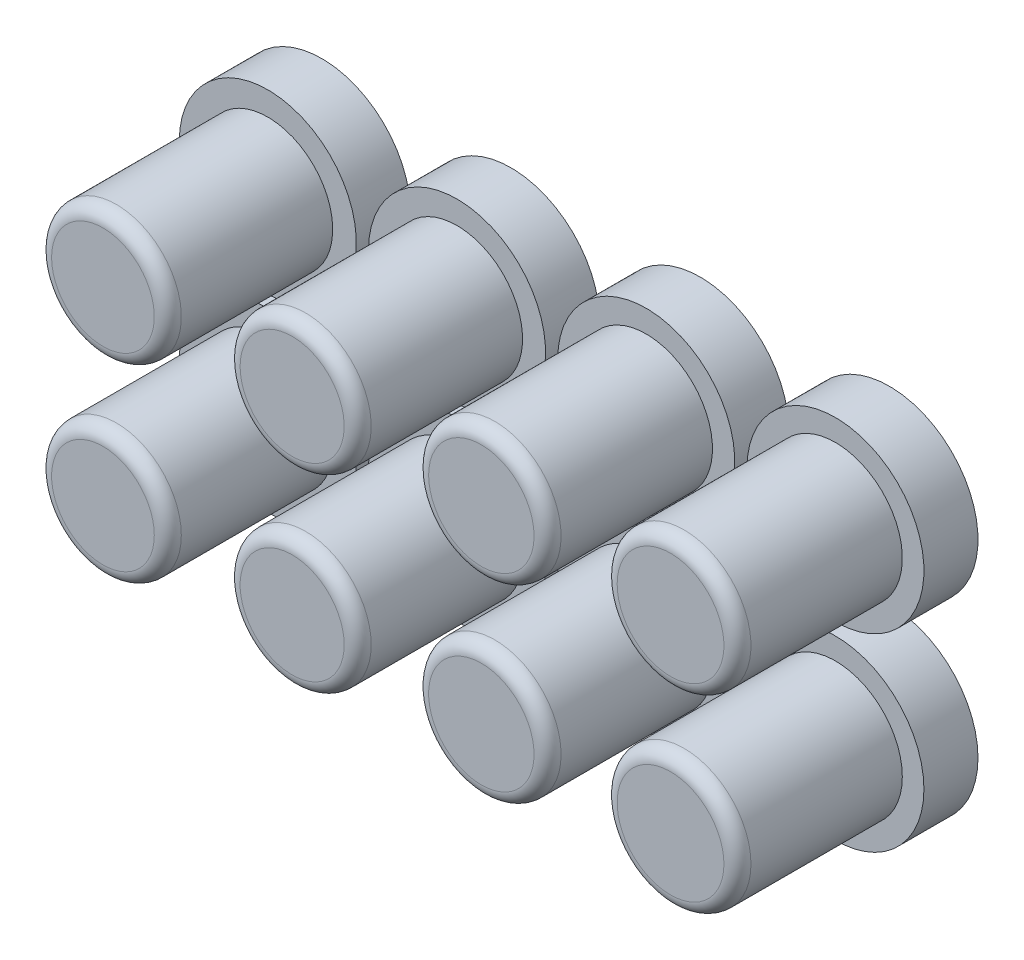
from build123d import *

# Parameters (mm, degrees)
SKETCH4_R             = 3.275
BOSS_EXTRUDE4_DEPTH   = 2
BOSS_EXTRUDE4_2_DEPTH = 2
BOSS_EXTRUDE4_3_DEPTH = 2
BOSS_EXTRUDE4_4_DEPTH = 2
BOSS_EXTRUDE4_5_DEPTH = 2
BOSS_EXTRUDE4_6_DEPTH = 2
BOSS_EXTRUDE4_7_DEPTH = 2
BOSS_EXTRUDE4_8_DEPTH = 2
SKETCH1_R             = 2.4
SKETCH1_R_2           = 2.425
SKETCH1_R_3           = 2.45
SKETCH1_R_4           = 2.475
BOSS_EXTRUDE5_DEPTH   = 6.1
CUT_EXTRUDE1_START    = -1.8
CUT_EXTRUDE1_DEPTH    = 6.1
FILLET1_R             = 0.5
FILLET2_R             = 0.5
FILLET3_R             = 0.5
FILLET4_R             = 0.5
FILLET5_R             = 0.5
FILLET6_R             = 0.5
FILLET7_R             = 0.5
FILLET8_R             = 0.5
CUT_EXTRUDE2_START    = -1.8
CUT_EXTRUDE2_DEPTH    = 1


with BuildPart() as part:
    # Sketch4 → Boss-Extrude4 (new body)
    with BuildSketch(Plane.XY):
        with Locations((-10.5, -3.5)):
            Circle(SKETCH4_R)
    extrude(amount=-BOSS_EXTRUDE4_DEPTH)



with BuildPart() as body_2:
    # Sketch4 → Boss-Extrude4 2 (new body)
    with BuildSketch(Plane.XY):
        with Locations((-3.5, -3.5)):
            Circle(SKETCH4_R)
    extrude(amount=-BOSS_EXTRUDE4_2_DEPTH)


with BuildPart() as body_3:
    # Sketch4 → Boss-Extrude4 3 (new body)
    with BuildSketch(Plane.XY):
        with Locations((3.5, -3.5)):
            Circle(SKETCH4_R)
    extrude(amount=-BOSS_EXTRUDE4_3_DEPTH)


with BuildPart() as body_4:
    # Sketch4 → Boss-Extrude4 4 (new body)
    with BuildSketch(Plane.XY):
        with Locations((10.5, -3.5)):
            Circle(SKETCH4_R)
    extrude(amount=-BOSS_EXTRUDE4_4_DEPTH)


with BuildPart() as body_5:
    # Sketch4 → Boss-Extrude4 5 (new body)
    with BuildSketch(Plane.XY):
        with Locations(Location((-10.5, 3.5, 0), (0, 0, 180))):
            Circle(SKETCH4_R)
    extrude(amount=-BOSS_EXTRUDE4_5_DEPTH)


with BuildPart() as body_6:
    # Sketch4 → Boss-Extrude4 6 (new body)
    with BuildSketch(Plane.XY):
        with Locations(Location((-3.5, 3.5, 0), (0, 0, 180))):
            Circle(SKETCH4_R)
    extrude(amount=-BOSS_EXTRUDE4_6_DEPTH)


with BuildPart() as body_7:
    # Sketch4 → Boss-Extrude4 7 (new body)
    with BuildSketch(Plane.XY):
        with Locations(Location((3.5, 3.5, 0), (0, 0, 180))):
            Circle(SKETCH4_R)
    extrude(amount=-BOSS_EXTRUDE4_7_DEPTH)


with BuildPart() as body_8:
    # Sketch4 → Boss-Extrude4 8 (new body)
    with BuildSketch(Plane.XY):
        with Locations(Location((10.5, 3.5, 0), (0, 0, 180))):
            Circle(SKETCH4_R)
    extrude(amount=-BOSS_EXTRUDE4_8_DEPTH)


with BuildPart() as part_1:
    add(part.part)

    add(body_2.part)  # Boss-Extrude5 merges body 2

    add(body_3.part)  # Boss-Extrude5 merges body 3

    add(body_4.part)  # Boss-Extrude5 merges body 4
    # Sketch1 → Boss-Extrude5 (add)
    with BuildSketch(Plane.XY):
        with Locations((-10.5, -3.5)):
            Circle(SKETCH1_R)
        with Locations((-3.5, -3.5)):
            Circle(SKETCH1_R_2)
        with Locations((3.5, -3.5)):
            Circle(SKETCH1_R_3)
        with Locations((10.5, -3.5)):
            Circle(SKETCH1_R_4)
        with Locations(Location((10.5, 3.5, 0), (0, 0, 180))):
            Circle(SKETCH1_R_4)
        with Locations(Location((3.5, 3.5, 0), (0, 0, 180))):
            Circle(SKETCH1_R_3)
        with Locations(Location((-3.5, 3.5, 0), (0, 0, 180))):
            Circle(SKETCH1_R_2)
        with Locations(Location((-10.5, 3.5, 0), (0, 0, 180))):
            Circle(SKETCH1_R)
    extrude(amount=BOSS_EXTRUDE5_DEPTH)

    # Sketch6 → Cut-Extrude1 (cut)
    # profile 1 of 14: a face of its own
    with BuildSketch(Plane.XY.offset(CUT_EXTRUDE1_START)):
        Polygon((11.75507977, -2.629655205), (11.72773602, -2.629655205), (11.72773602, -3.668116743), (11.554659097, -3.668116743), (11.554659097, -3.821962897), (11.72773602, -3.821962897), (11.72773602, -4.168116743), (11.862351404, -4.168116743), (11.862351404, -3.821962897), (12.573889866, -3.821962897), align=None)
        Polygon((11.862351404, -3.668116743), (11.862351404, -3.016674435), (12.309466789, -3.668116743), align=None, mode=Mode.SUBTRACT)
    # profile 2 of 14: a face of its own
    with BuildSketch(Plane.XY.offset(CUT_EXTRUDE1_START)):
        with BuildLine():
            add(Edge.make_bspline(
                [(11.179659097, -3.937347512), (11.171306148, -3.937843869), (11.15493117, -3.93881692), (11.131257258, -3.945492637), (11.109830975, -3.957346349), (11.090745728, -3.973144682), (11.075014381, -3.992299966), (11.06273823, -4.013555356), (11.056120665, -4.037427467), (11.055154702, -4.053897328), (11.054659097, -4.062347512)],
                knots=[0, 0, 0, 0, 1.020151414, 1.999887582, 2.974338812, 3.990962822, 5.007586832, 5.987933904, 6.967670073, 8, 8, 8, 8], degree=3))
            add(Edge.make_bspline(
                [(11.054659097, -4.062347512), (11.055171497, -4.070594654), (11.056181943, -4.086857895), (11.062723061, -4.110549951), (11.075107939, -4.131818624), (11.090637222, -4.151233826), (11.109835693, -4.167065628), (11.131307913, -4.17881849), (11.154875595, -4.185972195), (11.171296877, -4.186883466), (11.179659097, -4.187347512)],
                knots=[0, 0, 0, 0, 1.009421747, 1.99056486, 2.972319754, 3.999869655, 5.017953583, 5.993804169, 6.978383603, 8, 8, 8, 8], degree=3))
            add(Edge.make_bspline(
                [(11.179659097, -4.187347512), (11.188027342, -4.186900256), (11.204364349, -4.186027096), (11.22784406, -4.178671607), (11.249447047, -4.167175839), (11.268641781, -4.151204306), (11.284301126, -4.13191853), (11.296140575, -4.110403475), (11.303250639, -4.086925716), (11.304185728, -4.070608012), (11.304659097, -4.062347512)],
                knots=[0, 0, 0, 0, 1.022052826, 1.995314843, 2.982371812, 4.00089066, 5.028879526, 6.005146991, 6.990147033, 8, 8, 8, 8], degree=3))
            add(Edge.make_bspline(
                [(11.304659097, -4.062347512), (11.304203911, -4.053883492), (11.303315218, -4.037358532), (11.296125649, -4.013701772), (11.284392987, -3.992201012), (11.268533532, -3.973173907), (11.249451691, -3.957236491), (11.227896174, -3.945637294), (11.2043078, -3.938762832), (11.188017826, -3.937827467), (11.179659097, -3.937347512)],
                knots=[0, 0, 0, 0, 1.032775665, 2.016367738, 2.991239715, 4.008302682, 5.025365648, 6.011011707, 6.979408107, 8, 8, 8, 8], degree=3))
        make_face()
    # profile 3 of 14: a face of its own
    with BuildSketch(Plane.XY.offset(CUT_EXTRUDE1_START)):
        with BuildLine():
            Line((10.535428327, -4.206578282), (10.643000443, -4.13175857))
            Line((10.643000443, -4.13175857), (10.225933135, -3.522083089))
            add(Edge.make_bspline(
                [(10.225933135, -3.522083089), (10.25254345, -3.525337259), (10.304940645, -3.531744901), (10.357713688, -3.532922039), (10.383685539, -3.533501358)],
                knots=[0, 0, 0, 0, 1.015715272, 2, 2, 2, 2], degree=3))
            add(Edge.make_bspline(
                [(10.383685539, -3.533501358), (10.399432131, -3.53309804), (10.430341314, -3.532306361), (10.475783451, -3.5260313), (10.519448691, -3.51636696), (10.561221272, -3.501946065), (10.601258203, -3.484023975), (10.63947208, -3.461799541), (10.675811461, -3.435653987), (10.709886066, -3.405725562), (10.740876811, -3.37286354), (10.768486796, -3.33808255), (10.791432995, -3.300978563), (10.810494389, -3.262308469), (10.824950297, -3.221516461), (10.835477099, -3.179066718), (10.841958108, -3.134661729), (10.842729149, -3.104436673), (10.843120635, -3.089090301)],
                knots=[0, 0, 0, 0, 1.060718605, 2.082097864, 3.085795603, 4.069760067, 5.054557537, 6.03741023, 7.043284206, 8.066802108, 9.088538119, 10.083643548, 11.053783639, 12.022749082, 12.983451788, 13.964007469, 14.966251758, 16, 16, 16, 16], degree=3))
            add(Edge.make_bspline(
                [(10.843120635, -3.089090301), (10.842377306, -3.068103735), (10.840918301, -3.026911365), (10.82917608, -2.966725464), (10.809864506, -2.909816945), (10.782938059, -2.856335433), (10.749023178, -2.807050259), (10.708262354, -2.76264657), (10.660903512, -2.723755918), (10.608025504, -2.690325599), (10.550874209, -2.663439172), (10.491016213, -2.643622329), (10.428910161, -2.631965722), (10.386838303, -2.630428925), (10.365656693, -2.629655205)],
                knots=[0, 0, 0, 0, 1.022988612, 2.007919123, 2.978103895, 3.94594894, 4.918897164, 5.887013414, 6.875921846, 7.89917871, 8.930658928, 9.948724884, 10.967259574, 12, 12, 12, 12], degree=3))
            add(Edge.make_bspline(
                [(10.365656693, -2.629655205), (10.344875941, -2.63043956), (10.303815136, -2.631989373), (10.243434133, -2.643339645), (10.185602268, -2.662469648), (10.130640131, -2.68890589), (10.079751812, -2.722043421), (10.03399075, -2.761529646), (9.994401233, -2.807389158), (9.961048141, -2.858512796), (9.934275267, -2.913441502), (9.914958574, -2.970777469), (9.903067586, -3.03010835), (9.90156916, -3.070305982), (9.900812943, -3.090592705)],
                knots=[0, 0, 0, 0, 1.026385292, 2.028040595, 3.023318987, 4.028184125, 5.03290303, 6.015178782, 7.004435299, 8.016004309, 9.023023918, 10.015172535, 10.998308025, 12, 12, 12, 12], degree=3))
            add(Edge.make_bspline(
                [(9.900812943, -3.090592705), (9.901317975, -3.106340033), (9.902342307, -3.138279551), (9.90951501, -3.186806841), (9.921695089, -3.236285939), (9.935517246, -3.278166623), (9.948859604, -3.312755958), (9.961417231, -3.340078064), (9.975351012, -3.368835748), (9.991601911, -3.398727465), (10.009071467, -3.430134265), (10.028811157, -3.462741144), (10.050370687, -3.496591855), (10.065726282, -3.519412036), (10.073589385, -3.531097512)],
                knots=[0, 0, 0, 0, 1.179839688, 2.393009684, 3.667231171, 4.993948276, 5.694988576, 6.444077775, 7.246288328, 8.089075292, 8.993003841, 9.939041771, 10.944649915, 12, 12, 12, 12], degree=3))
            Line((10.073589385, -3.531097512), (10.535428327, -4.206578282))
        make_face()
        with BuildLine():
            add(Edge.make_bspline(
                [(10.358745635, -3.379655205), (10.346816772, -3.379329326), (10.323595331, -3.378694951), (10.289576488, -3.374833847), (10.257466115, -3.367987853), (10.227178437, -3.358165119), (10.198409765, -3.346312261), (10.171617053, -3.33122141), (10.146777877, -3.313214281), (10.123725909, -3.292981417), (10.103255623, -3.270502595), (10.085022896, -3.246975264), (10.06952551, -3.222296145), (10.057284105, -3.196156176), (10.047219287, -3.169191658), (10.040268711, -3.140968363), (10.036418282, -3.111633334), (10.035761893, -3.091705338), (10.035428327, -3.081578282)],
                knots=[0, 0, 0, 0, 1.163407946, 2.26475976, 3.333800367, 4.359385343, 5.366239384, 6.363380779, 7.350133999, 8.353570782, 9.349036268, 10.310270964, 11.253520213, 12.184142, 13.120487599, 14.056272588, 15.012232024, 16, 16, 16, 16], degree=3))
            add(Edge.make_bspline(
                [(10.035428327, -3.081578282), (10.035715328, -3.071446996), (10.036280899, -3.051482056), (10.040818313, -3.022103596), (10.048800552, -2.993949342), (10.05951076, -2.966865158), (10.073619433, -2.94107357), (10.090549498, -2.916250767), (10.110663405, -2.892554141), (10.133807362, -2.870541005), (10.158765028, -2.850249049), (10.185362385, -2.83234073), (10.213380206, -2.817331646), (10.242647559, -2.804946373), (10.273225423, -2.795281327), (10.305095704, -2.788331028), (10.338419449, -2.78448599), (10.36104, -2.783833749), (10.37256775, -2.783501358)],
                knots=[0, 0, 0, 0, 0.972161553, 1.915763587, 2.844109794, 3.775983486, 4.705125789, 5.659731448, 6.655561913, 7.682237399, 8.721216875, 9.739758359, 10.754845918, 11.767244016, 12.7857855, 13.828538656, 14.893392813, 16, 16, 16, 16], degree=3))
            add(Edge.make_bspline(
                [(10.37256775, -2.783501358), (10.383995245, -2.783834286), (10.406415894, -2.784487488), (10.439443391, -2.788323719), (10.471098178, -2.795328069), (10.501587443, -2.804941897), (10.530853927, -2.81733257), (10.558870426, -2.832341517), (10.585474005, -2.850244926), (10.610407742, -2.870556972), (10.633592566, -2.892451677), (10.65336065, -2.916354575), (10.670329461, -2.941060657), (10.684418748, -2.966868589), (10.695134112, -2.993948426), (10.70311497, -3.022103845), (10.707652755, -3.051481992), (10.708218275, -3.071446975), (10.70850525, -3.081578282)],
                knots=[0, 0, 0, 0, 1.099389452, 2.15699305, 3.192601482, 4.213358962, 5.227959689, 6.245255729, 7.266013209, 8.307253147, 9.336162325, 10.327954924, 11.284637477, 12.215801273, 13.149702402, 14.080068371, 15.025723358, 16, 16, 16, 16], degree=3))
            add(Edge.make_bspline(
                [(10.70850525, -3.081578282), (10.708245568, -3.091713224), (10.707733426, -3.111701185), (10.702792945, -3.141069639), (10.694530825, -3.169221722), (10.683465372, -3.196431168), (10.668893262, -3.222433393), (10.651011613, -3.24710512), (10.630052093, -3.270726027), (10.606294884, -3.292929118), (10.580294243, -3.313308621), (10.552524209, -3.331107357), (10.523462851, -3.346138404), (10.493007866, -3.358198997), (10.461384952, -3.36788971), (10.428309896, -3.37482123), (10.39389208, -3.378657915), (10.370573516, -3.379319585), (10.358745635, -3.379655205)],
                knots=[0, 0, 0, 0, 0.952633368, 1.87876736, 2.791047057, 3.707742249, 4.635551637, 5.587206343, 6.568248508, 7.601284464, 8.641511608, 9.671105535, 10.699146789, 11.713763218, 12.747829548, 13.806491675, 14.887386225, 16, 16, 16, 16], degree=3))
        make_face(mode=Mode.SUBTRACT)
    # profile 4 of 14: a face of its own
    with BuildSketch(Plane.XY.offset(CUT_EXTRUDE1_START)):
        with BuildLine():
            Line((8.766197558, -2.668116743), (8.766197558, -2.821962897))
            Line((8.766197558, -2.821962897), (9.276413904, -2.821962897))
            Line((9.276413904, -2.821962897), (9.357243231, -3.216494147))
            add(Edge.make_bspline(
                [(9.357243231, -3.216494147), (9.341362142, -3.212109745), (9.310595044, -3.203615659), (9.265183675, -3.194184614), (9.222072731, -3.188499424), (9.194097572, -3.187723148), (9.180560539, -3.187347512)],
                knots=[0, 0, 0, 0, 1.100273476, 2.13160584, 3.095893838, 4, 4, 4, 4], degree=3))
            add(Edge.make_bspline(
                [(9.180560539, -3.187347512), (9.163810365, -3.187710056), (9.130875337, -3.188422908), (9.082687217, -3.195267986), (9.036687406, -3.206042235), (8.992972104, -3.221093888), (8.95146044, -3.240340916), (8.912534342, -3.264383748), (8.875609522, -3.292469461), (8.84134841, -3.32476018), (8.810266564, -3.360298016), (8.782938283, -3.398508532), (8.759725744, -3.439020388), (8.741056849, -3.482220648), (8.726149277, -3.527631714), (8.716226994, -3.575731392), (8.709619833, -3.626066301), (8.708881667, -3.660482545), (8.70850525, -3.678032608)],
                knots=[0, 0, 0, 0, 1.052922333, 2.070308379, 3.05430497, 4.020497103, 4.973039431, 5.925935799, 6.892292201, 7.88610001, 8.88166317, 9.857072816, 10.836096531, 11.812156883, 12.81219415, 13.836441305, 14.89672472, 16, 16, 16, 16], degree=3))
            add(Edge.make_bspline(
                [(8.70850525, -3.678032608), (8.708790283, -3.690256417), (8.709356495, -3.71453884), (8.71223589, -3.750600641), (8.717779768, -3.785898998), (8.725223079, -3.820438594), (8.734884115, -3.854154039), (8.746579424, -3.887141837), (8.760892007, -3.919196669), (8.776591168, -3.950621838), (8.79426823, -3.980706912), (8.81388759, -4.008842192), (8.834615658, -4.035449742), (8.856919109, -4.060244199), (8.881005249, -4.083062635), (8.906582378, -4.10404047), (8.9334464, -4.123532468), (8.962012933, -4.140747409), (8.991645426, -4.156588676), (9.022771804, -4.169584478), (9.054683533, -4.181203276), (9.087839908, -4.190464502), (9.122165828, -4.197721311), (9.157717875, -4.20265014), (9.19430959, -4.206240041), (9.219113167, -4.206464766), (9.23164227, -4.206578282)],
                knots=[0, 0, 0, 0, 1.056347294, 2.098418968, 3.122841568, 4.141288669, 5.149314143, 6.15115421, 7.162517403, 8.180376062, 9.185164535, 10.17417709, 11.141909838, 12.097768115, 13.052685741, 14.0056014, 14.954263652, 15.917497458, 16.885230207, 17.854509472, 18.828990115, 19.81800267, 20.826176721, 21.857883937, 22.917946725, 24, 24, 24, 24], degree=3))
            add(Edge.make_bspline(
                [(9.23164227, -4.206578282), (9.246588347, -4.206282208), (9.275992989, -4.205699719), (9.319073232, -4.199606082), (9.360522349, -4.190878689), (9.400006678, -4.177748859), (9.437880076, -4.161297162), (9.47363267, -4.140504517), (9.508178002, -4.116942044), (9.540111732, -4.089136178), (9.569750067, -4.058743743), (9.596281428, -4.025761897), (9.619910103, -3.990734993), (9.640257709, -3.953492927), (9.657614004, -3.914133557), (9.671248999, -3.872509413), (9.682254008, -3.828837983), (9.68690976, -3.798772193), (9.689274481, -3.783501358)],
                knots=[0, 0, 0, 0, 1.0467383, 2.05933395, 3.04377827, 4.011590433, 4.970194871, 5.932262533, 6.905835911, 7.896367577, 8.894135286, 9.877477877, 10.858688626, 11.851381753, 12.8477658, 13.868841284, 14.917554742, 16, 16, 16, 16], degree=3))
            Line((9.689274481, -3.783501358), (9.554659097, -3.783501358))
            add(Edge.make_bspline(
                [(9.554659097, -3.783501358), (9.551346858, -3.797805552), (9.544980551, -3.825299007), (9.531006658, -3.863926725), (9.513921283, -3.898349249), (9.493605134, -3.929021928), (9.469369406, -3.955768641), (9.441713937, -3.979604525), (9.41070777, -4.001108152), (9.376253529, -4.019032195), (9.339905066, -4.034318803), (9.301861976, -4.044498101), (9.263160113, -4.051655627), (9.236983669, -4.052372096), (9.22382977, -4.052732128)],
                knots=[0, 0, 0, 0, 1.136247022, 2.183929868, 3.172523383, 4.106158343, 5.02341133, 5.958108904, 6.928429099, 7.938127109, 8.96079061, 9.975095812, 10.982467395, 12, 12, 12, 12], degree=3))
            add(Edge.make_bspline(
                [(9.22382977, -4.052732128), (9.210990436, -4.052380366), (9.185709684, -4.051687744), (9.148504804, -4.046356738), (9.112585001, -4.038146351), (9.078304705, -4.02585927), (9.045064045, -4.010925819), (9.013703858, -3.991762215), (8.98331691, -3.969707922), (8.95484771, -3.944440794), (8.928773661, -3.91659664), (8.905735323, -3.886820614), (8.886545217, -3.855056251), (8.870373456, -3.821853471), (8.858093471, -3.786848375), (8.849333051, -3.750205015), (8.844188883, -3.71183288), (8.843481234, -3.685660319), (8.843120635, -3.672323474)],
                knots=[0, 0, 0, 0, 1.027316725, 2.022795036, 3.002884548, 3.971462791, 4.93288096, 5.914575861, 6.907176829, 7.935150275, 8.956128384, 9.956726525, 10.942570165, 11.921478529, 12.907843606, 13.90538589, 14.932640048, 16, 16, 16, 16], degree=3))
            add(Edge.make_bspline(
                [(8.843120635, -3.672323474), (8.843402841, -3.660291009), (8.843955218, -3.636739171), (8.848468319, -3.602282368), (8.85631845, -3.569679636), (8.867214399, -3.538773535), (8.881048473, -3.509534917), (8.897954036, -3.481933606), (8.918248349, -3.456333391), (8.941430587, -3.432722297), (8.966826891, -3.410931636), (8.994874209, -3.392355599), (9.024985606, -3.376728206), (9.056798291, -3.363241921), (9.091068962, -3.353555887), (9.127118948, -3.346283936), (9.165337537, -3.342077352), (9.191467832, -3.341493686), (9.204899481, -3.341193666)],
                knots=[0, 0, 0, 0, 1.045622112, 2.046656509, 3.013763289, 3.955457236, 4.890082067, 5.820317437, 6.762574623, 7.722996705, 8.69280354, 9.665887285, 10.63943826, 11.638615906, 12.663482002, 13.728887084, 14.832589034, 16, 16, 16, 16], degree=3))
            add(Edge.make_bspline(
                [(9.204899481, -3.341193666), (9.216526165, -3.341442491), (9.240532317, -3.341956251), (9.277356386, -3.345739035), (9.316052839, -3.35184159), (9.356473337, -3.360235696), (9.398739269, -3.371220443), (9.44276144, -3.384383801), (9.488632412, -3.4001218), (9.519540008, -3.412007035), (9.535428327, -3.418116743)],
                knots=[0, 0, 0, 0, 0.817624296, 1.688186739, 2.600797293, 3.572016777, 4.590301741, 5.671205678, 6.80286297, 8, 8, 8, 8], degree=3))
            Line((9.535428327, -3.418116743), (9.381582173, -2.668116743))
            Line((9.381582173, -2.668116743), (8.766197558, -2.668116743))
        make_face()
    # profile 5 of 14: a face of its own
    with BuildSketch(Plane.XY.offset(CUT_EXTRUDE1_START)):
        Polygon((4.274310539, -2.629655205), (4.246966789, -2.629655205), (4.246966789, -3.668116743), (4.073889866, -3.668116743), (4.073889866, -3.821962897), (4.246966789, -3.821962897), (4.246966789, -4.168116743), (4.381582173, -4.168116743), (4.381582173, -3.821962897), (5.093120635, -3.821962897), align=None)
        Polygon((4.381582173, -3.668116743), (4.381582173, -3.016674435), (4.828697558, -3.668116743), align=None, mode=Mode.SUBTRACT)
    # profile 6 of 14: a face of its own
    with BuildSketch(Plane.XY.offset(CUT_EXTRUDE1_START)):
        with BuildLine():
            add(Edge.make_bspline(
                [(3.698889866, -3.937347512), (3.690536918, -3.937843869), (3.67416194, -3.93881692), (3.650488027, -3.945492637), (3.629061745, -3.957346349), (3.609976497, -3.973144682), (3.59424515, -3.992299966), (3.581968999, -4.013555356), (3.575351434, -4.037427467), (3.574385472, -4.053897328), (3.573889866, -4.062347512)],
                knots=[0, 0, 0, 0, 1.020151414, 1.999887582, 2.974338812, 3.990962822, 5.007586832, 5.987933904, 6.967670073, 8, 8, 8, 8], degree=3))
            add(Edge.make_bspline(
                [(3.573889866, -4.062347512), (3.574402266, -4.070594654), (3.575412712, -4.086857895), (3.58195383, -4.110549951), (3.594338708, -4.131818624), (3.609867991, -4.151233826), (3.629066463, -4.167065628), (3.650538683, -4.17881849), (3.674106365, -4.185972195), (3.690527646, -4.186883466), (3.698889866, -4.187347512)],
                knots=[0, 0, 0, 0, 1.009421747, 1.99056486, 2.972319754, 3.999869655, 5.017953583, 5.993804169, 6.978383603, 8, 8, 8, 8], degree=3))
            add(Edge.make_bspline(
                [(3.698889866, -4.187347512), (3.707258111, -4.186900256), (3.723595118, -4.186027096), (3.74707483, -4.178671607), (3.768677816, -4.167175839), (3.78787255, -4.151204306), (3.803531895, -4.13191853), (3.815371345, -4.110403475), (3.822481408, -4.086925716), (3.823416497, -4.070608012), (3.823889866, -4.062347512)],
                knots=[0, 0, 0, 0, 1.022052826, 1.995314843, 2.982371812, 4.00089066, 5.028879526, 6.005146991, 6.990147033, 8, 8, 8, 8], degree=3))
            add(Edge.make_bspline(
                [(3.823889866, -4.062347512), (3.82343468, -4.053883492), (3.822545987, -4.037358532), (3.815356418, -4.013701772), (3.803623756, -3.992201012), (3.787764301, -3.973173907), (3.76868246, -3.957236491), (3.747126943, -3.945637294), (3.723538569, -3.938762832), (3.707248595, -3.937827467), (3.698889866, -3.937347512)],
                knots=[0, 0, 0, 0, 1.032775665, 2.016367738, 2.991239715, 4.008302682, 5.025365648, 6.011011707, 6.979408107, 8, 8, 8, 8], degree=3))
        make_face()
    # profile 7 of 14: a face of its own
    with BuildSketch(Plane.XY.offset(CUT_EXTRUDE1_START)):
        with BuildLine():
            Line((3.054659097, -4.206578282), (3.162231212, -4.13175857))
            Line((3.162231212, -4.13175857), (2.745163904, -3.522083089))
            add(Edge.make_bspline(
                [(2.745163904, -3.522083089), (2.77177422, -3.525337259), (2.824171414, -3.531744901), (2.876944458, -3.532922039), (2.902916308, -3.533501358)],
                knots=[0, 0, 0, 0, 1.015715272, 2, 2, 2, 2], degree=3))
            add(Edge.make_bspline(
                [(2.902916308, -3.533501358), (2.9186629, -3.53309804), (2.949572083, -3.532306361), (2.99501422, -3.5260313), (3.03867946, -3.51636696), (3.080452041, -3.501946065), (3.120488972, -3.484023975), (3.158702849, -3.461799541), (3.195042231, -3.435653987), (3.229116835, -3.405725562), (3.26010758, -3.37286354), (3.287717565, -3.33808255), (3.310663764, -3.300978563), (3.329725158, -3.262308469), (3.344181067, -3.221516461), (3.354707868, -3.179066718), (3.361188877, -3.134661729), (3.361959918, -3.104436673), (3.362351404, -3.089090301)],
                knots=[0, 0, 0, 0, 1.060718605, 2.082097864, 3.085795603, 4.069760067, 5.054557537, 6.03741023, 7.043284206, 8.066802108, 9.088538119, 10.083643548, 11.053783639, 12.022749082, 12.983451788, 13.964007469, 14.966251758, 16, 16, 16, 16], degree=3))
            add(Edge.make_bspline(
                [(3.362351404, -3.089090301), (3.361608075, -3.068103735), (3.360149071, -3.026911365), (3.348406849, -2.966725464), (3.329095275, -2.909816945), (3.302168828, -2.856335433), (3.268253947, -2.807050259), (3.227493123, -2.76264657), (3.180134281, -2.723755918), (3.127256273, -2.690325599), (3.070104978, -2.663439172), (3.010246982, -2.643622329), (2.94814093, -2.631965722), (2.906069072, -2.630428925), (2.884887462, -2.629655205)],
                knots=[0, 0, 0, 0, 1.022988612, 2.007919123, 2.978103895, 3.94594894, 4.918897164, 5.887013414, 6.875921846, 7.89917871, 8.930658928, 9.948724884, 10.967259574, 12, 12, 12, 12], degree=3))
            add(Edge.make_bspline(
                [(2.884887462, -2.629655205), (2.864106711, -2.63043956), (2.823045905, -2.631989373), (2.762664902, -2.643339645), (2.704833038, -2.662469648), (2.649870901, -2.68890589), (2.598982581, -2.722043421), (2.553221519, -2.761529646), (2.513632002, -2.807389158), (2.480278911, -2.858512796), (2.453506036, -2.913441502), (2.434189343, -2.970777469), (2.422298355, -3.03010835), (2.420799929, -3.070305982), (2.420043712, -3.090592705)],
                knots=[0, 0, 0, 0, 1.026385292, 2.028040595, 3.023318987, 4.028184125, 5.03290303, 6.015178782, 7.004435299, 8.016004309, 9.023023918, 10.015172535, 10.998308025, 12, 12, 12, 12], degree=3))
            add(Edge.make_bspline(
                [(2.420043712, -3.090592705), (2.420548744, -3.106340033), (2.421573076, -3.138279551), (2.428745779, -3.186806841), (2.440925859, -3.236285939), (2.454748015, -3.278166623), (2.468090373, -3.312755958), (2.480648001, -3.340078064), (2.494581781, -3.368835748), (2.51083268, -3.398727465), (2.528302236, -3.430134265), (2.548041926, -3.462741144), (2.569601457, -3.496591855), (2.584957051, -3.519412036), (2.592820154, -3.531097512)],
                knots=[0, 0, 0, 0, 1.179839688, 2.393009684, 3.667231171, 4.993948276, 5.694988576, 6.444077775, 7.246288328, 8.089075292, 8.993003841, 9.939041771, 10.944649915, 12, 12, 12, 12], degree=3))
            Line((2.592820154, -3.531097512), (3.054659097, -4.206578282))
        make_face()
        with BuildLine():
            add(Edge.make_bspline(
                [(2.877976404, -3.379655205), (2.866047541, -3.379329326), (2.8428261, -3.378694951), (2.808807257, -3.374833847), (2.776696884, -3.367987853), (2.746409206, -3.358165119), (2.717640534, -3.346312261), (2.690847822, -3.33122141), (2.666008647, -3.313214281), (2.642956678, -3.292981417), (2.622486392, -3.270502595), (2.604253665, -3.246975264), (2.588756279, -3.222296145), (2.576514874, -3.196156176), (2.566450056, -3.169191658), (2.55949948, -3.140968363), (2.555649051, -3.111633334), (2.554992662, -3.091705338), (2.554659097, -3.081578282)],
                knots=[0, 0, 0, 0, 1.163407946, 2.26475976, 3.333800367, 4.359385343, 5.366239384, 6.363380779, 7.350133999, 8.353570782, 9.349036268, 10.310270964, 11.253520213, 12.184142, 13.120487599, 14.056272588, 15.012232024, 16, 16, 16, 16], degree=3))
            add(Edge.make_bspline(
                [(2.554659097, -3.081578282), (2.554946098, -3.071446996), (2.555511668, -3.051482056), (2.560049083, -3.022103596), (2.568031321, -2.993949342), (2.578741529, -2.966865158), (2.592850202, -2.94107357), (2.609780268, -2.916250767), (2.629894175, -2.892554141), (2.653038131, -2.870541005), (2.677995797, -2.850249049), (2.704593154, -2.83234073), (2.732610975, -2.817331646), (2.761878328, -2.804946373), (2.792456192, -2.795281327), (2.824326473, -2.788331028), (2.857650218, -2.78448599), (2.880270769, -2.783833749), (2.89179852, -2.783501358)],
                knots=[0, 0, 0, 0, 0.972161553, 1.915763587, 2.844109794, 3.775983486, 4.705125789, 5.659731448, 6.655561913, 7.682237399, 8.721216875, 9.739758359, 10.754845918, 11.767244016, 12.7857855, 13.828538656, 14.893392813, 16, 16, 16, 16], degree=3))
            add(Edge.make_bspline(
                [(2.89179852, -2.783501358), (2.903226014, -2.783834286), (2.925646664, -2.784487488), (2.958674161, -2.788323719), (2.990328947, -2.795328069), (3.020818213, -2.804941897), (3.050084696, -2.81733257), (3.078101195, -2.832341517), (3.104704774, -2.850244926), (3.129638512, -2.870556972), (3.152823335, -2.892451677), (3.172591419, -2.916354575), (3.18956023, -2.941060657), (3.203649517, -2.966868589), (3.214364881, -2.993948426), (3.222345739, -3.022103845), (3.226883524, -3.051481992), (3.227449044, -3.071446975), (3.22773602, -3.081578282)],
                knots=[0, 0, 0, 0, 1.099389452, 2.15699305, 3.192601482, 4.213358962, 5.227959689, 6.245255729, 7.266013209, 8.307253147, 9.336162325, 10.327954924, 11.284637477, 12.215801273, 13.149702402, 14.080068371, 15.025723358, 16, 16, 16, 16], degree=3))
            add(Edge.make_bspline(
                [(3.22773602, -3.081578282), (3.227476337, -3.091713224), (3.226964195, -3.111701185), (3.222023714, -3.141069639), (3.213761594, -3.169221722), (3.202696141, -3.196431168), (3.188124031, -3.222433393), (3.170242382, -3.24710512), (3.149282862, -3.270726027), (3.125525653, -3.292929118), (3.099525013, -3.313308621), (3.071754979, -3.331107357), (3.04269362, -3.346138404), (3.012238635, -3.358198997), (2.980615721, -3.36788971), (2.947540665, -3.37482123), (2.913122849, -3.378657915), (2.889804285, -3.379319585), (2.877976404, -3.379655205)],
                knots=[0, 0, 0, 0, 0.952633368, 1.87876736, 2.791047057, 3.707742249, 4.635551637, 5.587206343, 6.568248508, 7.601284464, 8.641511608, 9.671105535, 10.699146789, 11.713763218, 12.747829548, 13.806491675, 14.887386225, 16, 16, 16, 16], degree=3))
        make_face(mode=Mode.SUBTRACT)
    # profile 8 of 14: a face of its own
    with BuildSketch(Plane.XY.offset(CUT_EXTRUDE1_START)):
        Polygon((-2.052612538, -2.629655205), (-2.079956288, -2.629655205), (-2.079956288, -3.668116743), (-2.253033211, -3.668116743), (-2.253033211, -3.821962897), (-2.079956288, -3.821962897), (-2.079956288, -4.168116743), (-1.945340903, -4.168116743), (-1.945340903, -3.821962897), (-1.233802442, -3.821962897), align=None)
        Polygon((-1.945340903, -3.668116743), (-1.945340903, -3.016674435), (-1.498225519, -3.668116743), align=None, mode=Mode.SUBTRACT)
    # profile 9 of 14: a face of its own
    with BuildSketch(Plane.XY.offset(CUT_EXTRUDE1_START)):
        with BuildLine():
            add(Edge.make_bspline(
                [(-2.628033211, -3.937347512), (-2.636386159, -3.937843869), (-2.652761137, -3.93881692), (-2.67643505, -3.945492637), (-2.697861332, -3.957346349), (-2.71694658, -3.973144682), (-2.732677927, -3.992299966), (-2.744954078, -4.013555356), (-2.751571643, -4.037427467), (-2.752537605, -4.053897328), (-2.753033211, -4.062347512)],
                knots=[0, 0, 0, 0, 1.020151414, 1.999887582, 2.974338812, 3.990962822, 5.007586832, 5.987933904, 6.967670073, 8, 8, 8, 8], degree=3))
            add(Edge.make_bspline(
                [(-2.753033211, -4.062347512), (-2.752520811, -4.070594654), (-2.751510365, -4.086857895), (-2.744969247, -4.110549951), (-2.732584368, -4.131818624), (-2.717055086, -4.151233826), (-2.697856614, -4.167065628), (-2.676384394, -4.17881849), (-2.652816712, -4.185972195), (-2.636395431, -4.186883466), (-2.628033211, -4.187347512)],
                knots=[0, 0, 0, 0, 1.009421747, 1.99056486, 2.972319754, 3.999869655, 5.017953583, 5.993804169, 6.978383603, 8, 8, 8, 8], degree=3))
            add(Edge.make_bspline(
                [(-2.628033211, -4.187347512), (-2.619664966, -4.186900256), (-2.603327959, -4.186027096), (-2.579848247, -4.178671607), (-2.558245261, -4.167175839), (-2.539050527, -4.151204306), (-2.523391182, -4.13191853), (-2.511551732, -4.110403475), (-2.504441668, -4.086925716), (-2.50350658, -4.070608012), (-2.503033211, -4.062347512)],
                knots=[0, 0, 0, 0, 1.022052826, 1.995314843, 2.982371812, 4.00089066, 5.028879526, 6.005146991, 6.990147033, 8, 8, 8, 8], degree=3))
            add(Edge.make_bspline(
                [(-2.503033211, -4.062347512), (-2.503488397, -4.053883492), (-2.50437709, -4.037358532), (-2.511566659, -4.013701772), (-2.523299321, -3.992201012), (-2.539158776, -3.973173907), (-2.558240617, -3.957236491), (-2.579796134, -3.945637294), (-2.603384508, -3.938762832), (-2.619674482, -3.937827467), (-2.628033211, -3.937347512)],
                knots=[0, 0, 0, 0, 1.032775665, 2.016367738, 2.991239715, 4.008302682, 5.025365648, 6.011011707, 6.979408107, 8, 8, 8, 8], degree=3))
        make_face()
    # profile 10 of 14: a face of its own
    with BuildSketch(Plane.XY.offset(CUT_EXTRUDE1_START)):
        with BuildLine():
            add(Edge.make_bspline(
                [(-3.67460773, -3.332479724), (-3.686885679, -3.338881705), (-3.71083178, -3.351367706), (-3.744936297, -3.371472347), (-3.776104155, -3.392661332), (-3.80520011, -3.413933843), (-3.831712975, -3.43610455), (-3.855346295, -3.459261617), (-3.876683846, -3.482827023), (-3.895295325, -3.507199811), (-3.911665398, -3.532315232), (-3.925813456, -3.558239206), (-3.937906543, -3.584914921), (-3.947490659, -3.612633562), (-3.955385713, -3.64098796), (-3.960818115, -3.670344238), (-3.963739651, -3.700508956), (-3.964292, -3.720895371), (-3.964571673, -3.731217705)],
                knots=[0, 0, 0, 0, 1.272397273, 2.481599622, 3.635517121, 4.734568067, 5.792894095, 6.808321871, 7.773003508, 8.711915296, 9.623354172, 10.525449501, 11.423591555, 12.311487226, 13.218079475, 14.126165749, 15.051214107, 16, 16, 16, 16], degree=3))
            add(Edge.make_bspline(
                [(-3.964571673, -3.731217705), (-3.964241064, -3.74565959), (-3.963586665, -3.7742455), (-3.957886672, -3.816436691), (-3.949352538, -3.857413169), (-3.93688989, -3.89716595), (-3.920727008, -3.935475682), (-3.900808364, -3.972375156), (-3.878260705, -4.008469146), (-3.860152602, -4.030677461), (-3.850989942, -4.04191482)],
                knots=[0, 0, 0, 0, 1.025265484, 2.029385089, 3.018602448, 3.995076438, 4.983346944, 5.966715145, 6.97116228, 8, 8, 8, 8], degree=3))
            add(Edge.make_bspline(
                [(-3.850989942, -4.04191482), (-3.839060024, -4.055026437), (-3.815347611, -4.081087649), (-3.774726356, -4.11492371), (-3.730145548, -4.143359165), (-3.681777692, -4.166532834), (-3.629752077, -4.18456963), (-3.574079789, -4.19753071), (-3.514652295, -4.204954608), (-3.473807093, -4.206027746), (-3.452852923, -4.206578282)],
                knots=[0, 0, 0, 0, 0.954267603, 1.896743057, 2.838368354, 3.796610408, 4.779680527, 5.799409237, 6.871065594, 8, 8, 8, 8], degree=3))
            add(Edge.make_bspline(
                [(-3.452852923, -4.206578282), (-3.432704328, -4.206084362), (-3.393497208, -4.205123246), (-3.336429546, -4.198611347), (-3.283233945, -4.187199404), (-3.233601101, -4.171580286), (-3.187830233, -4.151261616), (-3.146051761, -4.125972298), (-3.107662915, -4.096730252), (-3.073828713, -4.062695647), (-3.043790808, -4.026242273), (-3.0174045, -3.98863444), (-2.995472752, -3.949868715), (-2.976903996, -3.910523129), (-2.96268913, -3.870046206), (-2.952843897, -3.828646201), (-2.946591333, -3.786395425), (-2.945759419, -3.757881859), (-2.945340903, -3.743537416)],
                knots=[0, 0, 0, 0, 1.256902934, 2.445805442, 3.576955095, 4.645999104, 5.686449165, 6.692658513, 7.68621702, 8.689161843, 9.678783111, 10.630372946, 11.551080876, 12.453998257, 13.34127905, 14.221779781, 15.105423033, 16, 16, 16, 16], degree=3))
            add(Edge.make_bspline(
                [(-2.945340903, -3.743537416), (-2.945588567, -3.733012048), (-2.946078037, -3.712210206), (-2.949465829, -3.681477637), (-2.954912312, -3.651565007), (-2.962309222, -3.622361832), (-2.972333948, -3.594080715), (-2.984437719, -3.566587655), (-2.998551413, -3.539851612), (-3.014871913, -3.513726377), (-3.033858494, -3.488578015), (-3.055357201, -3.463979732), (-3.079797717, -3.440313217), (-3.106908142, -3.417289321), (-3.136378659, -3.394499618), (-3.168974743, -3.373175734), (-3.203832286, -3.351808035), (-3.228606032, -3.339033038), (-3.241314461, -3.332479724)],
                knots=[0, 0, 0, 0, 0.941657376, 1.861047343, 2.762797495, 3.66048619, 4.553285746, 5.444104102, 6.34607688, 7.256116206, 8.197091036, 9.162375105, 10.176350973, 11.237807142, 12.343728897, 13.50695164, 14.721116704, 16, 16, 16, 16], degree=3))
            add(Edge.make_bspline(
                [(-3.241314461, -3.332479724), (-3.223918158, -3.322993394), (-3.190234045, -3.304625205), (-3.145632856, -3.270876574), (-3.107322589, -3.234324654), (-3.076356281, -3.194197599), (-3.051982469, -3.151748938), (-3.03526021, -3.107244259), (-3.023947431, -3.061508782), (-3.022826791, -3.030263269), (-3.02226398, -3.01457107)],
                knots=[0, 0, 0, 0, 1.166880483, 2.259407225, 3.286803203, 4.280235371, 5.237608625, 6.161067461, 7.076446754, 8, 8, 8, 8], degree=3))
            add(Edge.make_bspline(
                [(-3.02226398, -3.01457107), (-3.022964876, -2.998586402), (-3.0243738, -2.966454432), (-3.035766651, -2.918623236), (-3.054332394, -2.871644708), (-3.07958425, -2.825746546), (-3.111035914, -2.782482168), (-3.148770148, -2.743678905), (-3.191885847, -2.70968827), (-3.24016779, -2.681155625), (-3.292126176, -2.657934057), (-3.346947201, -2.641914732), (-3.403675698, -2.631442111), (-3.442289006, -2.630256402), (-3.461867346, -2.629655205)],
                knots=[0, 0, 0, 0, 0.888701115, 1.786444228, 2.72001202, 3.692817113, 4.693886446, 5.687152267, 6.695133018, 7.739871481, 8.800368666, 9.853104506, 10.91144658, 12, 12, 12, 12], degree=3))
            add(Edge.make_bspline(
                [(-3.461867346, -2.629655205), (-3.480940409, -2.630275066), (-3.518550318, -2.631497362), (-3.57383373, -2.641691738), (-3.626730106, -2.658718675), (-3.677057034, -2.681817485), (-3.723913548, -2.710269031), (-3.765314538, -2.744726549), (-3.801885645, -2.783358642), (-3.832136099, -2.8266099), (-3.857063052, -2.872331698), (-3.874420581, -2.920169921), (-3.885542856, -2.969090946), (-3.886945726, -3.002192948), (-3.887648596, -3.018777801)],
                knots=[0, 0, 0, 0, 1.072916533, 2.115669174, 3.151510826, 4.193348718, 5.225979165, 6.227137561, 7.216255879, 8.211077061, 9.189680878, 10.138522389, 11.067357538, 12, 12, 12, 12], degree=3))
            add(Edge.make_bspline(
                [(-3.887648596, -3.018777801), (-3.887033784, -3.035053514), (-3.885826329, -3.067018089), (-3.875669212, -3.113615169), (-3.858563506, -3.157253186), (-3.835208865, -3.198427309), (-3.80476937, -3.236390807), (-3.767651342, -3.271626437), (-3.724150708, -3.30442365), (-3.691467471, -3.322932091), (-3.67460773, -3.332479724)],
                knots=[0, 0, 0, 0, 0.975232327, 1.915300861, 2.843280834, 3.77672583, 4.742871857, 5.749627742, 6.839139064, 8, 8, 8, 8], degree=3))
        make_face()
        with BuildLine():
            add(Edge.make_bspline(
                [(-3.454355327, -2.783501358), (-3.443833553, -2.783780547), (-3.423248362, -2.784326763), (-3.393064646, -2.787180464), (-3.364362203, -2.792731843), (-3.336841145, -2.800119862), (-3.310878797, -2.810100428), (-3.28612256, -2.821841147), (-3.262993764, -2.836115175), (-3.241213206, -2.852127117), (-3.221605731, -2.869738362), (-3.20420378, -2.888087099), (-3.189748874, -2.907533695), (-3.177474113, -2.927594421), (-3.168567748, -2.948864668), (-3.161897332, -2.970692315), (-3.157388164, -2.993353194), (-3.157050283, -3.00884027), (-3.156879365, -3.016674435)],
                knots=[0, 0, 0, 0, 1.203892937, 2.355340988, 3.463153438, 4.544400666, 5.610487187, 6.640501085, 7.674077295, 8.714426146, 9.728707835, 10.68524104, 11.601827946, 12.495867327, 13.368432065, 14.231010473, 15.105153427, 16, 16, 16, 16], degree=3))
            add(Edge.make_bspline(
                [(-3.156879365, -3.016674435), (-3.157173951, -3.024508939), (-3.157756095, -3.039991045), (-3.162258292, -3.062853559), (-3.168968373, -3.085319975), (-3.179532942, -3.106856079), (-3.192204239, -3.128208948), (-3.207843443, -3.148844913), (-3.226481597, -3.168835792), (-3.247493358, -3.188011553), (-3.270384017, -3.205968166), (-3.294634321, -3.221556672), (-3.319939917, -3.234599862), (-3.346040804, -3.245455321), (-3.373202996, -3.253893866), (-3.401260056, -3.259880429), (-3.4302167, -3.263601285), (-3.449836949, -3.264045722), (-3.45976398, -3.264270589)],
                knots=[0, 0, 0, 0, 0.873023192, 1.725219244, 2.590779336, 3.480155217, 4.391973325, 5.357036234, 6.360879153, 7.436073238, 8.526419356, 9.601555421, 10.645666583, 11.697338044, 12.750135903, 13.812665442, 14.89329948, 16, 16, 16, 16], degree=3))
            add(Edge.make_bspline(
                [(-3.45976398, -3.264270589), (-3.472514025, -3.263896503), (-3.497888182, -3.263152026), (-3.53529361, -3.256230095), (-3.571663315, -3.245341844), (-3.60660856, -3.230444716), (-3.639224811, -3.211747062), (-3.668299125, -3.189361482), (-3.693583508, -3.163804869), (-3.714815198, -3.135475083), (-3.731276561, -3.105324402), (-3.744091621, -3.075067134), (-3.751574999, -3.044380463), (-3.7525511, -3.023823193), (-3.753033211, -3.013669628)],
                knots=[0, 0, 0, 0, 1.076279235, 2.141928126, 3.20205304, 4.278698113, 5.344010996, 6.36967002, 7.368914609, 8.37248503, 9.349703398, 10.264243087, 11.142681841, 12, 12, 12, 12], degree=3))
            add(Edge.make_bspline(
                [(-3.753033211, -3.013669628), (-3.752805255, -3.006543327), (-3.752352795, -2.99239864), (-3.748624199, -2.971510769), (-3.742463128, -2.951098091), (-3.734121808, -2.930991975), (-3.723146182, -2.911474518), (-3.710132959, -2.892238909), (-3.694325315, -2.873717867), (-3.676583987, -2.855479775), (-3.656464526, -2.838600908), (-3.634005706, -2.823757461), (-3.60932267, -2.811152165), (-3.582414835, -2.800914127), (-3.553381296, -2.793224549), (-3.522355778, -2.787466114), (-3.489079586, -2.784220495), (-3.466181122, -2.78374627), (-3.454355327, -2.783501358)],
                knots=[0, 0, 0, 0, 0.814439003, 1.616544685, 2.417341072, 3.248991801, 4.09997495, 4.973547432, 5.9003056, 6.880240646, 7.880314356, 8.896779544, 9.951930927, 11.043077905, 12.18215768, 13.381699519, 14.647792085, 16, 16, 16, 16], degree=3))
        make_face(mode=Mode.SUBTRACT)
        with BuildLine():
            add(Edge.make_bspline(
                [(-3.463069269, -3.418116743), (-3.449729646, -3.418354018), (-3.423560562, -3.418819493), (-3.385221879, -3.424000708), (-3.348427665, -3.431213305), (-3.313301978, -3.442155093), (-3.279859651, -3.45638216), (-3.247919644, -3.473496963), (-3.217726303, -3.493727867), (-3.189696563, -3.516817845), (-3.16410085, -3.541700468), (-3.141644436, -3.568041383), (-3.12257407, -3.59535104), (-3.107216962, -3.623976281), (-3.094611934, -3.653310972), (-3.086334558, -3.684085655), (-3.081028111, -3.715708704), (-3.080315554, -3.737205889), (-3.079956288, -3.748044628)],
                knots=[0, 0, 0, 0, 1.140299081, 2.23698856, 3.303958914, 4.344563908, 5.37730929, 6.408454204, 7.439741482, 8.480804886, 9.510774543, 10.48932336, 11.43758569, 12.353841022, 13.263987381, 14.161954604, 15.073269652, 16, 16, 16, 16], degree=3))
            add(Edge.make_bspline(
                [(-3.079956288, -3.748044628), (-3.080540542, -3.761515016), (-3.081699688, -3.788239952), (-3.09089539, -3.827738411), (-3.105653477, -3.865976006), (-3.126235712, -3.902641128), (-3.151721815, -3.93690546), (-3.183061729, -3.966772078), (-3.218307803, -3.993309854), (-3.258652597, -4.01477294), (-3.30272194, -4.031913592), (-3.350504109, -4.043723291), (-3.40131336, -4.051541055), (-3.436396043, -4.052328847), (-3.454355327, -4.052732128)],
                knots=[0, 0, 0, 0, 0.898778495, 1.783155532, 2.693654817, 3.627872908, 4.583023416, 5.533784346, 6.509005473, 7.520592997, 8.575161974, 9.658835044, 10.801527049, 12, 12, 12, 12], degree=3))
            add(Edge.make_bspline(
                [(-3.454355327, -4.052732128), (-3.468391198, -4.052462638), (-3.495737578, -4.051937587), (-3.535631556, -4.047302889), (-3.57327922, -4.03995305), (-3.608607562, -4.029262959), (-3.642012065, -4.016212969), (-3.672926359, -3.999424934), (-3.702145728, -3.980331081), (-3.728230352, -3.957677586), (-3.751987442, -3.933472088), (-3.77270171, -3.907847784), (-3.790683517, -3.881501084), (-3.804796784, -3.853836591), (-3.816079464, -3.825385056), (-3.824189559, -3.795884123), (-3.829193652, -3.765243308), (-3.82969975, -3.744457992), (-3.829956288, -3.733922032)],
                knots=[0, 0, 0, 0, 1.224942928, 2.386581632, 3.501229538, 4.569074225, 5.605009692, 6.626002462, 7.634866581, 8.645888296, 9.63523824, 10.59253846, 11.518950513, 12.414518923, 13.29783783, 14.186679152, 15.080837789, 16, 16, 16, 16], degree=3))
            add(Edge.make_bspline(
                [(-3.829956288, -3.733922032), (-3.829568067, -3.723688886), (-3.828802564, -3.703510909), (-3.823943982, -3.673610969), (-3.815408606, -3.644724049), (-3.803696864, -3.616502618), (-3.788105023, -3.589518496), (-3.769742936, -3.563068708), (-3.747588314, -3.537887375), (-3.722554344, -3.513778905), (-3.695271932, -3.491486447), (-3.666271727, -3.471765973), (-3.635776958, -3.455157923), (-3.603852153, -3.441650854), (-3.570568201, -3.431027652), (-3.535949581, -3.423606512), (-3.499955763, -3.418935253), (-3.475503676, -3.418392662), (-3.463069269, -3.418116743)],
                knots=[0, 0, 0, 0, 0.917430815, 1.809013306, 2.70690318, 3.612392954, 4.541220862, 5.495268465, 6.494511384, 7.542276156, 8.608045339, 9.649016899, 10.681629292, 11.715607085, 12.752076957, 13.808767841, 14.885711793, 16, 16, 16, 16], degree=3))
        make_face(mode=Mode.SUBTRACT)
    # profile 11 of 14: a face of its own
    with BuildSketch(Plane.XY.offset(CUT_EXTRUDE1_START)):
        with BuildLine():
            Line((-5.04149475, -2.668116743), (-5.04149475, -2.821962897))
            Line((-5.04149475, -2.821962897), (-4.531278403, -2.821962897))
            Line((-4.531278403, -2.821962897), (-4.450449077, -3.216494147))
            add(Edge.make_bspline(
                [(-4.450449077, -3.216494147), (-4.466330166, -3.212109745), (-4.497097264, -3.203615659), (-4.542508633, -3.194184614), (-4.585619577, -3.188499424), (-4.613594736, -3.187723148), (-4.627131769, -3.187347512)],
                knots=[0, 0, 0, 0, 1.100273476, 2.13160584, 3.095893838, 4, 4, 4, 4], degree=3))
            add(Edge.make_bspline(
                [(-4.627131769, -3.187347512), (-4.643881943, -3.187710056), (-4.67681697, -3.188422908), (-4.725005091, -3.195267986), (-4.771004902, -3.206042235), (-4.814720203, -3.221093888), (-4.856231868, -3.240340916), (-4.895157966, -3.264383748), (-4.932082786, -3.292469461), (-4.966343897, -3.32476018), (-4.997425744, -3.360298016), (-5.024754025, -3.398508532), (-5.047966564, -3.439020388), (-5.066635459, -3.482220648), (-5.08154303, -3.527631714), (-5.091465314, -3.575731392), (-5.098072475, -3.626066301), (-5.09881064, -3.660482545), (-5.099187057, -3.678032608)],
                knots=[0, 0, 0, 0, 1.052922333, 2.070308379, 3.05430497, 4.020497103, 4.973039431, 5.925935799, 6.892292201, 7.88610001, 8.88166317, 9.857072816, 10.836096531, 11.812156883, 12.81219415, 13.836441305, 14.89672472, 16, 16, 16, 16], degree=3))
            add(Edge.make_bspline(
                [(-5.099187057, -3.678032608), (-5.098902025, -3.690256417), (-5.098335812, -3.71453884), (-5.095456418, -3.750600641), (-5.089912539, -3.785898998), (-5.082469229, -3.820438594), (-5.072808193, -3.854154039), (-5.061112884, -3.887141837), (-5.046800301, -3.919196669), (-5.03110114, -3.950621838), (-5.013424078, -3.980706912), (-4.993804718, -4.008842192), (-4.97307665, -4.035449742), (-4.950773199, -4.060244199), (-4.926687058, -4.083062635), (-4.90110993, -4.10404047), (-4.874245907, -4.123532468), (-4.845679375, -4.140747409), (-4.816046882, -4.156588676), (-4.784920503, -4.169584478), (-4.753008775, -4.181203276), (-4.719852399, -4.190464502), (-4.68552648, -4.197721311), (-4.649974433, -4.20265014), (-4.613382717, -4.206240041), (-4.58857914, -4.206464766), (-4.576050038, -4.206578282)],
                knots=[0, 0, 0, 0, 1.056347294, 2.098418968, 3.122841568, 4.141288669, 5.149314143, 6.15115421, 7.162517403, 8.180376062, 9.185164535, 10.17417709, 11.141909838, 12.097768115, 13.052685741, 14.0056014, 14.954263652, 15.917497458, 16.885230207, 17.854509472, 18.828990115, 19.81800267, 20.826176721, 21.857883937, 22.917946725, 24, 24, 24, 24], degree=3))
            add(Edge.make_bspline(
                [(-4.576050038, -4.206578282), (-4.561103961, -4.206282208), (-4.531699319, -4.205699719), (-4.488619076, -4.199606082), (-4.447169959, -4.190878689), (-4.40768563, -4.177748859), (-4.369812231, -4.161297162), (-4.334059638, -4.140504517), (-4.299514305, -4.116942044), (-4.267580575, -4.089136178), (-4.237942241, -4.058743743), (-4.21141088, -4.025761897), (-4.187782204, -3.990734993), (-4.167434598, -3.953492927), (-4.150078304, -3.914133557), (-4.136443309, -3.872509413), (-4.125438299, -3.828837983), (-4.120782548, -3.798772193), (-4.118417827, -3.783501358)],
                knots=[0, 0, 0, 0, 1.0467383, 2.05933395, 3.04377827, 4.011590433, 4.970194871, 5.932262533, 6.905835911, 7.896367577, 8.894135286, 9.877477877, 10.858688626, 11.851381753, 12.8477658, 13.868841284, 14.917554742, 16, 16, 16, 16], degree=3))
            Line((-4.118417827, -3.783501358), (-4.253033211, -3.783501358))
            add(Edge.make_bspline(
                [(-4.253033211, -3.783501358), (-4.25634545, -3.797805552), (-4.262711757, -3.825299007), (-4.276685649, -3.863926725), (-4.293771025, -3.898349249), (-4.314087174, -3.929021928), (-4.338322901, -3.955768641), (-4.365978371, -3.979604525), (-4.396984538, -4.001108152), (-4.431438779, -4.019032195), (-4.467787242, -4.034318803), (-4.505830332, -4.044498101), (-4.544532194, -4.051655627), (-4.570708639, -4.052372096), (-4.583862538, -4.052732128)],
                knots=[0, 0, 0, 0, 1.136247022, 2.183929868, 3.172523383, 4.106158343, 5.02341133, 5.958108904, 6.928429099, 7.938127109, 8.96079061, 9.975095812, 10.982467395, 12, 12, 12, 12], degree=3))
            add(Edge.make_bspline(
                [(-4.583862538, -4.052732128), (-4.596701871, -4.052380366), (-4.621982624, -4.051687744), (-4.659187504, -4.046356738), (-4.695107307, -4.038146351), (-4.729387603, -4.02585927), (-4.762628263, -4.010925819), (-4.79398845, -3.991762215), (-4.824375397, -3.969707922), (-4.852844597, -3.944440794), (-4.878918647, -3.91659664), (-4.901956985, -3.886820614), (-4.92114709, -3.855056251), (-4.937318851, -3.821853471), (-4.949598837, -3.786848375), (-4.958359257, -3.750205015), (-4.963503425, -3.71183288), (-4.964211074, -3.685660319), (-4.964571673, -3.672323474)],
                knots=[0, 0, 0, 0, 1.027316725, 2.022795036, 3.002884548, 3.971462791, 4.93288096, 5.914575861, 6.907176829, 7.935150275, 8.956128384, 9.956726525, 10.942570165, 11.921478529, 12.907843606, 13.90538589, 14.932640048, 16, 16, 16, 16], degree=3))
            add(Edge.make_bspline(
                [(-4.964571673, -3.672323474), (-4.964289467, -3.660291009), (-4.96373709, -3.636739171), (-4.959223989, -3.602282368), (-4.951373858, -3.569679636), (-4.940477909, -3.538773535), (-4.926643834, -3.509534917), (-4.909738272, -3.481933606), (-4.889443958, -3.456333391), (-4.86626172, -3.432722297), (-4.840865417, -3.410931636), (-4.812818099, -3.392355599), (-4.782706702, -3.376728206), (-4.750894016, -3.363241921), (-4.716623345, -3.353555887), (-4.68057336, -3.346283936), (-4.642354771, -3.342077352), (-4.616224476, -3.341493686), (-4.602792827, -3.341193666)],
                knots=[0, 0, 0, 0, 1.045622112, 2.046656509, 3.013763289, 3.955457236, 4.890082067, 5.820317437, 6.762574623, 7.722996705, 8.69280354, 9.665887285, 10.63943826, 11.638615906, 12.663482002, 13.728887084, 14.832589034, 16, 16, 16, 16], degree=3))
            add(Edge.make_bspline(
                [(-4.602792827, -3.341193666), (-4.591166143, -3.341442491), (-4.56715999, -3.341956251), (-4.530335922, -3.345739035), (-4.491639469, -3.35184159), (-4.451218971, -3.360235696), (-4.408953039, -3.371220443), (-4.364930867, -3.384383801), (-4.319059896, -3.4001218), (-4.2881523, -3.412007035), (-4.27226398, -3.418116743)],
                knots=[0, 0, 0, 0, 0.817624296, 1.688186739, 2.600797293, 3.572016777, 4.590301741, 5.671205678, 6.80286297, 8, 8, 8, 8], degree=3))
            Line((-4.27226398, -3.418116743), (-4.426110134, -2.668116743))
            Line((-4.426110134, -2.668116743), (-5.04149475, -2.668116743))
        make_face()
    # profile 12 of 14: a face of its own
    with BuildSketch(Plane.XY.offset(CUT_EXTRUDE1_START)):
        Polygon((-10.110304846, -2.629655205), (-10.137648596, -2.629655205), (-10.137648596, -3.668116743), (-10.310725519, -3.668116743), (-10.310725519, -3.821962897), (-10.137648596, -3.821962897), (-10.137648596, -4.168116743), (-10.003033211, -4.168116743), (-10.003033211, -3.821962897), (-9.29149475, -3.821962897), align=None)
        Polygon((-10.003033211, -3.668116743), (-10.003033211, -3.016674435), (-9.555917827, -3.668116743), align=None, mode=Mode.SUBTRACT)
    # profile 13 of 14: a face of its own
    with BuildSketch(Plane.XY.offset(CUT_EXTRUDE1_START)):
        with BuildLine():
            add(Edge.make_bspline(
                [(-10.685725519, -3.937347512), (-10.694078467, -3.937843869), (-10.710453445, -3.93881692), (-10.734127357, -3.945492637), (-10.75555364, -3.957346349), (-10.774638888, -3.973144682), (-10.790370235, -3.992299966), (-10.802646386, -4.013555356), (-10.809263951, -4.037427467), (-10.810229913, -4.053897328), (-10.810725519, -4.062347512)],
                knots=[0, 0, 0, 0, 1.020151414, 1.999887582, 2.974338812, 3.990962822, 5.007586832, 5.987933904, 6.967670073, 8, 8, 8, 8], degree=3))
            add(Edge.make_bspline(
                [(-10.810725519, -4.062347512), (-10.810213118, -4.070594654), (-10.809202673, -4.086857895), (-10.802661555, -4.110549951), (-10.790276676, -4.131818624), (-10.774747393, -4.151233826), (-10.755548922, -4.167065628), (-10.734076702, -4.17881849), (-10.71050902, -4.185972195), (-10.694087739, -4.186883466), (-10.685725519, -4.187347512)],
                knots=[0, 0, 0, 0, 1.009421747, 1.99056486, 2.972319754, 3.999869655, 5.017953583, 5.993804169, 6.978383603, 8, 8, 8, 8], degree=3))
            add(Edge.make_bspline(
                [(-10.685725519, -4.187347512), (-10.677357274, -4.186900256), (-10.661020267, -4.186027096), (-10.637540555, -4.178671607), (-10.615937568, -4.167175839), (-10.596742835, -4.151204306), (-10.58108349, -4.13191853), (-10.56924404, -4.110403475), (-10.562133976, -4.086925716), (-10.561198888, -4.070608012), (-10.560725519, -4.062347512)],
                knots=[0, 0, 0, 0, 1.022052826, 1.995314843, 2.982371812, 4.00089066, 5.028879526, 6.005146991, 6.990147033, 8, 8, 8, 8], degree=3))
            add(Edge.make_bspline(
                [(-10.560725519, -4.062347512), (-10.561180704, -4.053883492), (-10.562069398, -4.037358532), (-10.569258967, -4.013701772), (-10.580991629, -3.992201012), (-10.596851084, -3.973173907), (-10.615932925, -3.957236491), (-10.637488441, -3.945637294), (-10.661076816, -3.938762832), (-10.677366789, -3.937827467), (-10.685725519, -3.937347512)],
                knots=[0, 0, 0, 0, 1.032775665, 2.016367738, 2.991239715, 4.008302682, 5.025365648, 6.011011707, 6.979408107, 8, 8, 8, 8], degree=3))
        make_face()
    # profile 14 of 14: a face of its own
    with BuildSketch(Plane.XY.offset(CUT_EXTRUDE1_START)):
        with BuildLine():
            add(Edge.make_bspline(
                [(-11.732300038, -3.332479724), (-11.744577987, -3.338881705), (-11.768524087, -3.351367706), (-11.802628605, -3.371472347), (-11.833796463, -3.392661332), (-11.862892418, -3.413933843), (-11.889405283, -3.43610455), (-11.913038602, -3.459261617), (-11.934376154, -3.482827023), (-11.952987633, -3.507199811), (-11.969357705, -3.532315232), (-11.983505763, -3.558239206), (-11.99559885, -3.584914921), (-12.005182967, -3.612633562), (-12.013078021, -3.64098796), (-12.018510423, -3.670344238), (-12.021431959, -3.700508956), (-12.021984307, -3.720895371), (-12.02226398, -3.731217705)],
                knots=[0, 0, 0, 0, 1.272397273, 2.481599622, 3.635517121, 4.734568067, 5.792894095, 6.808321871, 7.773003508, 8.711915296, 9.623354172, 10.525449501, 11.423591555, 12.311487226, 13.218079475, 14.126165749, 15.051214107, 16, 16, 16, 16], degree=3))
            add(Edge.make_bspline(
                [(-12.02226398, -3.731217705), (-12.021933372, -3.74565959), (-12.021278973, -3.7742455), (-12.01557898, -3.816436691), (-12.007044846, -3.857413169), (-11.994582198, -3.89716595), (-11.978419316, -3.935475682), (-11.958500672, -3.972375156), (-11.935953013, -4.008469146), (-11.91784491, -4.030677461), (-11.90868225, -4.04191482)],
                knots=[0, 0, 0, 0, 1.025265484, 2.029385089, 3.018602448, 3.995076438, 4.983346944, 5.966715145, 6.97116228, 8, 8, 8, 8], degree=3))
            add(Edge.make_bspline(
                [(-11.90868225, -4.04191482), (-11.896752332, -4.055026437), (-11.873039918, -4.081087649), (-11.832418664, -4.11492371), (-11.787837856, -4.143359165), (-11.739469999, -4.166532834), (-11.687444384, -4.18456963), (-11.631772097, -4.19753071), (-11.572344603, -4.204954608), (-11.531499401, -4.206027746), (-11.51054523, -4.206578282)],
                knots=[0, 0, 0, 0, 0.954267603, 1.896743057, 2.838368354, 3.796610408, 4.779680527, 5.799409237, 6.871065594, 8, 8, 8, 8], degree=3))
            add(Edge.make_bspline(
                [(-11.51054523, -4.206578282), (-11.490396635, -4.206084362), (-11.451189516, -4.205123246), (-11.394121854, -4.198611347), (-11.340926253, -4.187199404), (-11.291293409, -4.171580286), (-11.24552254, -4.151261616), (-11.203744068, -4.125972298), (-11.165355223, -4.096730252), (-11.13152102, -4.062695647), (-11.101483116, -4.026242273), (-11.075096807, -3.98863444), (-11.053165059, -3.949868715), (-11.034596304, -3.910523129), (-11.020381437, -3.870046206), (-11.010536204, -3.828646201), (-11.004283641, -3.786395425), (-11.003451726, -3.757881859), (-11.003033211, -3.743537416)],
                knots=[0, 0, 0, 0, 1.256902934, 2.445805442, 3.576955095, 4.645999104, 5.686449165, 6.692658513, 7.68621702, 8.689161843, 9.678783111, 10.630372946, 11.551080876, 12.453998257, 13.34127905, 14.221779781, 15.105423033, 16, 16, 16, 16], degree=3))
            add(Edge.make_bspline(
                [(-11.003033211, -3.743537416), (-11.003280874, -3.733012048), (-11.003770345, -3.712210206), (-11.007158137, -3.681477637), (-11.01260462, -3.651565007), (-11.02000153, -3.622361832), (-11.030026256, -3.594080715), (-11.042130027, -3.566587655), (-11.056243721, -3.539851612), (-11.07256422, -3.513726377), (-11.091550802, -3.488578015), (-11.113049509, -3.463979732), (-11.137490024, -3.440313217), (-11.164600449, -3.417289321), (-11.194070966, -3.394499618), (-11.226667051, -3.373175734), (-11.261524594, -3.351808035), (-11.286298339, -3.339033038), (-11.299006769, -3.332479724)],
                knots=[0, 0, 0, 0, 0.941657376, 1.861047343, 2.762797495, 3.66048619, 4.553285746, 5.444104102, 6.34607688, 7.256116206, 8.197091036, 9.162375105, 10.176350973, 11.237807142, 12.343728897, 13.50695164, 14.721116704, 16, 16, 16, 16], degree=3))
            add(Edge.make_bspline(
                [(-11.299006769, -3.332479724), (-11.281610465, -3.322993394), (-11.247926353, -3.304625205), (-11.203325164, -3.270876574), (-11.165014896, -3.234324654), (-11.134048589, -3.194197599), (-11.109674777, -3.151748938), (-11.092952518, -3.107244259), (-11.081639739, -3.061508782), (-11.080519099, -3.030263269), (-11.079956288, -3.01457107)],
                knots=[0, 0, 0, 0, 1.166880483, 2.259407225, 3.286803203, 4.280235371, 5.237608625, 6.161067461, 7.076446754, 8, 8, 8, 8], degree=3))
            add(Edge.make_bspline(
                [(-11.079956288, -3.01457107), (-11.080657184, -2.998586402), (-11.082066107, -2.966454432), (-11.093458959, -2.918623236), (-11.112024702, -2.871644708), (-11.137276558, -2.825746546), (-11.168728222, -2.782482168), (-11.206462456, -2.743678905), (-11.249578154, -2.70968827), (-11.297860097, -2.681155625), (-11.349818484, -2.657934057), (-11.404639509, -2.641914732), (-11.461368006, -2.631442111), (-11.499981314, -2.630256402), (-11.519559653, -2.629655205)],
                knots=[0, 0, 0, 0, 0.888701115, 1.786444228, 2.72001202, 3.692817113, 4.693886446, 5.687152267, 6.695133018, 7.739871481, 8.800368666, 9.853104506, 10.91144658, 12, 12, 12, 12], degree=3))
            add(Edge.make_bspline(
                [(-11.519559653, -2.629655205), (-11.538632717, -2.630275066), (-11.576242625, -2.631497362), (-11.631526037, -2.641691738), (-11.684422413, -2.658718675), (-11.734749341, -2.681817485), (-11.781605856, -2.710269031), (-11.823006846, -2.744726549), (-11.859577952, -2.783358642), (-11.889828407, -2.8266099), (-11.91475536, -2.872331698), (-11.932112889, -2.920169921), (-11.943235163, -2.969090946), (-11.944638034, -3.002192948), (-11.945340903, -3.018777801)],
                knots=[0, 0, 0, 0, 1.072916533, 2.115669174, 3.151510826, 4.193348718, 5.225979165, 6.227137561, 7.216255879, 8.211077061, 9.189680878, 10.138522389, 11.067357538, 12, 12, 12, 12], degree=3))
            add(Edge.make_bspline(
                [(-11.945340903, -3.018777801), (-11.944726092, -3.035053514), (-11.943518636, -3.067018089), (-11.93336152, -3.113615169), (-11.916255814, -3.157253186), (-11.892901172, -3.198427309), (-11.862461678, -3.236390807), (-11.825343649, -3.271626437), (-11.781843016, -3.30442365), (-11.749159779, -3.322932091), (-11.732300038, -3.332479724)],
                knots=[0, 0, 0, 0, 0.975232327, 1.915300861, 2.843280834, 3.77672583, 4.742871857, 5.749627742, 6.839139064, 8, 8, 8, 8], degree=3))
        make_face()
        with BuildLine():
            add(Edge.make_bspline(
                [(-11.512047634, -2.783501358), (-11.50152586, -2.783780547), (-11.48094067, -2.784326763), (-11.450756954, -2.787180464), (-11.42205451, -2.792731843), (-11.394533453, -2.800119862), (-11.368571105, -2.810100428), (-11.343814867, -2.821841147), (-11.320686072, -2.836115175), (-11.298905513, -2.852127117), (-11.279298038, -2.869738362), (-11.261896088, -2.888087099), (-11.247441182, -2.907533695), (-11.23516642, -2.927594421), (-11.226260056, -2.948864668), (-11.21958964, -2.970692315), (-11.215080472, -2.993353194), (-11.214742591, -3.00884027), (-11.214571673, -3.016674435)],
                knots=[0, 0, 0, 0, 1.203892937, 2.355340988, 3.463153438, 4.544400666, 5.610487187, 6.640501085, 7.674077295, 8.714426146, 9.728707835, 10.68524104, 11.601827946, 12.495867327, 13.368432065, 14.231010473, 15.105153427, 16, 16, 16, 16], degree=3))
            add(Edge.make_bspline(
                [(-11.214571673, -3.016674435), (-11.214866258, -3.024508939), (-11.215448402, -3.039991045), (-11.2199506, -3.062853559), (-11.226660681, -3.085319975), (-11.23722525, -3.106856079), (-11.249896546, -3.128208948), (-11.26553575, -3.148844913), (-11.284173905, -3.168835792), (-11.305185665, -3.188011553), (-11.328076324, -3.205968166), (-11.352326629, -3.221556672), (-11.377632225, -3.234599862), (-11.403733112, -3.245455321), (-11.430895303, -3.253893866), (-11.458952364, -3.259880429), (-11.487909007, -3.263601285), (-11.507529256, -3.264045722), (-11.517456288, -3.264270589)],
                knots=[0, 0, 0, 0, 0.873023192, 1.725219244, 2.590779336, 3.480155217, 4.391973325, 5.357036234, 6.360879153, 7.436073238, 8.526419356, 9.601555421, 10.645666583, 11.697338044, 12.750135903, 13.812665442, 14.89329948, 16, 16, 16, 16], degree=3))
            add(Edge.make_bspline(
                [(-11.517456288, -3.264270589), (-11.530206333, -3.263896503), (-11.55558049, -3.263152026), (-11.592985918, -3.256230095), (-11.629355623, -3.245341844), (-11.664300867, -3.230444716), (-11.696917118, -3.211747062), (-11.725991433, -3.189361482), (-11.751275816, -3.163804869), (-11.772507506, -3.135475083), (-11.788968869, -3.105324402), (-11.801783929, -3.075067134), (-11.809267307, -3.044380463), (-11.810243407, -3.023823193), (-11.810725519, -3.013669628)],
                knots=[0, 0, 0, 0, 1.076279235, 2.141928126, 3.20205304, 4.278698113, 5.344010996, 6.36967002, 7.368914609, 8.37248503, 9.349703398, 10.264243087, 11.142681841, 12, 12, 12, 12], degree=3))
            add(Edge.make_bspline(
                [(-11.810725519, -3.013669628), (-11.810497563, -3.006543327), (-11.810045103, -2.99239864), (-11.806316507, -2.971510769), (-11.800155436, -2.951098091), (-11.791814116, -2.930991975), (-11.780838489, -2.911474518), (-11.767825266, -2.892238909), (-11.752017623, -2.873717867), (-11.734276294, -2.855479775), (-11.714156833, -2.838600908), (-11.691698014, -2.823757461), (-11.667014978, -2.811152165), (-11.640107142, -2.800914127), (-11.611073603, -2.793224549), (-11.580048086, -2.787466114), (-11.546771894, -2.784220495), (-11.523873429, -2.78374627), (-11.512047634, -2.783501358)],
                knots=[0, 0, 0, 0, 0.814439003, 1.616544685, 2.417341072, 3.248991801, 4.09997495, 4.973547432, 5.9003056, 6.880240646, 7.880314356, 8.896779544, 9.951930927, 11.043077905, 12.18215768, 13.381699519, 14.647792085, 16, 16, 16, 16], degree=3))
        make_face(mode=Mode.SUBTRACT)
        with BuildLine():
            add(Edge.make_bspline(
                [(-11.520761577, -3.418116743), (-11.507421954, -3.418354018), (-11.48125287, -3.418819493), (-11.442914186, -3.424000708), (-11.406119973, -3.431213305), (-11.370994286, -3.442155093), (-11.337551958, -3.45638216), (-11.305611952, -3.473496963), (-11.27541861, -3.493727867), (-11.24738887, -3.516817845), (-11.221793158, -3.541700468), (-11.199336744, -3.568041383), (-11.180266378, -3.59535104), (-11.16490927, -3.623976281), (-11.152304242, -3.653310972), (-11.144026866, -3.684085655), (-11.138720418, -3.715708704), (-11.138007862, -3.737205889), (-11.137648596, -3.748044628)],
                knots=[0, 0, 0, 0, 1.140299081, 2.23698856, 3.303958914, 4.344563908, 5.37730929, 6.408454204, 7.439741482, 8.480804886, 9.510774543, 10.48932336, 11.43758569, 12.353841022, 13.263987381, 14.161954604, 15.073269652, 16, 16, 16, 16], degree=3))
            add(Edge.make_bspline(
                [(-11.137648596, -3.748044628), (-11.13823285, -3.761515016), (-11.139391995, -3.788239952), (-11.148587698, -3.827738411), (-11.163345784, -3.865976006), (-11.18392802, -3.902641128), (-11.209414122, -3.93690546), (-11.240754037, -3.966772078), (-11.27600011, -3.993309854), (-11.316344905, -4.01477294), (-11.360414248, -4.031913592), (-11.408196417, -4.043723291), (-11.459005668, -4.051541055), (-11.49408835, -4.052328847), (-11.512047634, -4.052732128)],
                knots=[0, 0, 0, 0, 0.898778495, 1.783155532, 2.693654817, 3.627872908, 4.583023416, 5.533784346, 6.509005473, 7.520592997, 8.575161974, 9.658835044, 10.801527049, 12, 12, 12, 12], degree=3))
            add(Edge.make_bspline(
                [(-11.512047634, -4.052732128), (-11.526083506, -4.052462638), (-11.553429886, -4.051937587), (-11.593323864, -4.047302889), (-11.630971528, -4.03995305), (-11.66629987, -4.029262959), (-11.699704372, -4.016212969), (-11.730618667, -3.999424934), (-11.759838036, -3.980331081), (-11.78592266, -3.957677586), (-11.809679749, -3.933472088), (-11.830394018, -3.907847784), (-11.848375825, -3.881501084), (-11.862489092, -3.853836591), (-11.873771772, -3.825385056), (-11.881881867, -3.795884123), (-11.886885959, -3.765243308), (-11.887392057, -3.744457992), (-11.887648596, -3.733922032)],
                knots=[0, 0, 0, 0, 1.224942928, 2.386581632, 3.501229538, 4.569074225, 5.605009692, 6.626002462, 7.634866581, 8.645888296, 9.63523824, 10.59253846, 11.518950513, 12.414518923, 13.29783783, 14.186679152, 15.080837789, 16, 16, 16, 16], degree=3))
            add(Edge.make_bspline(
                [(-11.887648596, -3.733922032), (-11.887260375, -3.723688886), (-11.886494871, -3.703510909), (-11.881636289, -3.673610969), (-11.873100913, -3.644724049), (-11.861389172, -3.616502618), (-11.845797331, -3.589518496), (-11.827435244, -3.563068708), (-11.805280621, -3.537887375), (-11.780246652, -3.513778905), (-11.75296424, -3.491486447), (-11.723964035, -3.471765973), (-11.693469265, -3.455157923), (-11.661544461, -3.441650854), (-11.628260508, -3.431027652), (-11.593641889, -3.423606512), (-11.557648071, -3.418935253), (-11.533195984, -3.418392662), (-11.520761577, -3.418116743)],
                knots=[0, 0, 0, 0, 0.917430815, 1.809013306, 2.70690318, 3.612392954, 4.541220862, 5.495268465, 6.494511384, 7.542276156, 8.608045339, 9.649016899, 10.681629292, 11.715607085, 12.752076957, 13.808767841, 14.885711793, 16, 16, 16, 16], degree=3))
        make_face(mode=Mode.SUBTRACT)
    extrude(amount=-CUT_EXTRUDE1_DEPTH, mode=Mode.SUBTRACT)

    # Fillet1
    fillet1_edges = [part_1.edges().sort_by_distance(p)[0] for p in [
        (-12.9, -3.5, 6.1),
    ]]
    fillet(fillet1_edges, radius=FILLET1_R)

    # Fillet2
    fillet2_edges = [part_1.edges().sort_by_distance(p)[0] for p in [
        (-5.925, -3.5, 6.1),
    ]]
    fillet(fillet2_edges, radius=FILLET2_R)

    # Fillet3
    fillet3_edges = [part_1.edges().sort_by_distance(p)[0] for p in [
        (1.05, -3.5, 6.1),
    ]]
    fillet(fillet3_edges, radius=FILLET3_R)

    # Fillet4
    fillet4_edges = [part_1.edges().sort_by_distance(p)[0] for p in [
        (8.025, -3.5, 6.1),
    ]]
    fillet(fillet4_edges, radius=FILLET4_R)

    # Fillet5
    fillet5_edges = [part_1.edges().sort_by_distance(p)[0] for p in [
        (12.975, 3.5, 6.1),
    ]]
    fillet(fillet5_edges, radius=FILLET5_R)

    # Fillet6
    fillet6_edges = [part_1.edges().sort_by_distance(p)[0] for p in [
        (5.95, 3.5, 6.1),
    ]]
    fillet(fillet6_edges, radius=FILLET6_R)

    # Fillet7
    fillet7_edges = [part_1.edges().sort_by_distance(p)[0] for p in [
        (-1.075, 3.5, 6.1),
    ]]
    fillet(fillet7_edges, radius=FILLET7_R)

    # Fillet8
    fillet8_edges = [part_1.edges().sort_by_distance(p)[0] for p in [
        (-8.1, 3.5, 6.1),
    ]]
    fillet(fillet8_edges, radius=FILLET8_R)


with BuildPart() as cut_extrude2_tool:
    # Sketch7 → Cut-Extrude2 (new body)
    # profile 1 of 14: a face of its own
    with BuildSketch(Plane.XY.offset(CUT_EXTRUDE2_START)):
        Polygon((11.671565177, 4.210928511), (11.644221427, 4.210928511), (11.644221427, 3.172466972), (11.471144504, 3.172466972), (11.471144504, 3.018620818), (11.644221427, 3.018620818), (11.644221427, 2.672466972), (11.778836811, 2.672466972), (11.778836811, 3.018620818), (12.490375273, 3.018620818), align=None)
        Polygon((11.778836811, 3.172466972), (11.778836811, 3.82390928), (12.225952196, 3.172466972), align=None, mode=Mode.SUBTRACT)
    # profile 2 of 14: a face of its own
    with BuildSketch(Plane.XY.offset(CUT_EXTRUDE2_START)):
        with BuildLine():
            add(Edge.make_bspline(
                [(11.096144504, 2.903236203), (11.087791556, 2.902739846), (11.071416577, 2.901766796), (11.047742665, 2.895091078), (11.026316383, 2.883237367), (11.007231135, 2.867439033), (10.991499788, 2.848283749), (10.979223637, 2.827028359), (10.972606072, 2.803156248), (10.97164011, 2.786686388), (10.971144504, 2.778236203)],
                knots=[0, 0, 0, 0, 1.020151414, 1.999887582, 2.974338812, 3.990962822, 5.007586832, 5.987933904, 6.967670073, 8, 8, 8, 8], degree=3))
            add(Edge.make_bspline(
                [(10.971144504, 2.778236203), (10.971656904, 2.769989062), (10.97266735, 2.75372582), (10.979208468, 2.730033765), (10.991593346, 2.708765091), (11.007122629, 2.689349889), (11.026321101, 2.673518088), (11.04779332, 2.661765226), (11.071361003, 2.65461152), (11.087782284, 2.65370025), (11.096144504, 2.653236203)],
                knots=[0, 0, 0, 0, 1.009421747, 1.99056486, 2.972319754, 3.999869655, 5.017953583, 5.993804169, 6.978383603, 8, 8, 8, 8], degree=3))
            add(Edge.make_bspline(
                [(11.096144504, 2.653236203), (11.104512749, 2.653683459), (11.120849756, 2.65455662), (11.144329468, 2.661912108), (11.165932454, 2.673407877), (11.185127188, 2.689379409), (11.200786533, 2.708665185), (11.212625983, 2.730180241), (11.219736046, 2.753658), (11.220671135, 2.769975704), (11.221144504, 2.778236203)],
                knots=[0, 0, 0, 0, 1.022052826, 1.995314843, 2.982371812, 4.00089066, 5.028879526, 6.005146991, 6.990147033, 8, 8, 8, 8], degree=3))
            add(Edge.make_bspline(
                [(11.221144504, 2.778236203), (11.220689318, 2.786700223), (11.219800625, 2.803225183), (11.212611056, 2.826881943), (11.200878394, 2.848382703), (11.185018939, 2.867409809), (11.165937098, 2.883347224), (11.144381581, 2.894946421), (11.120793207, 2.901820884), (11.104503233, 2.902756248), (11.096144504, 2.903236203)],
                knots=[0, 0, 0, 0, 1.032775665, 2.016367738, 2.991239715, 4.008302682, 5.025365648, 6.011011707, 6.979408107, 8, 8, 8, 8], degree=3))
        make_face()
    # profile 3 of 14: a face of its own
    with BuildSketch(Plane.XY.offset(CUT_EXTRUDE2_START)):
        with BuildLine():
            Line((10.451913734, 2.634005434), (10.55948585, 2.708825145))
            Line((10.55948585, 2.708825145), (10.142418542, 3.318500626))
            add(Edge.make_bspline(
                [(10.142418542, 3.318500626), (10.169028857, 3.315246456), (10.221426052, 3.308838814), (10.274199095, 3.307661676), (10.300170946, 3.307082357)],
                knots=[0, 0, 0, 0, 1.015715272, 2, 2, 2, 2], degree=3))
            add(Edge.make_bspline(
                [(10.300170946, 3.307082357), (10.315917538, 3.307485675), (10.346826721, 3.308277354), (10.392268858, 3.314552415), (10.435934098, 3.324216755), (10.477706679, 3.33863765), (10.51774361, 3.35655974), (10.555957487, 3.378784174), (10.592296868, 3.404929728), (10.626371473, 3.434858153), (10.657362218, 3.467720175), (10.684972203, 3.502501165), (10.707918402, 3.539605153), (10.726979796, 3.578275247), (10.741435705, 3.619067254), (10.751962506, 3.661516997), (10.758443515, 3.705921987), (10.759214556, 3.736147043), (10.759606042, 3.751493415)],
                knots=[0, 0, 0, 0, 1.060718605, 2.082097864, 3.085795603, 4.069760067, 5.054557537, 6.03741023, 7.043284206, 8.066802108, 9.088538119, 10.083643548, 11.053783639, 12.022749082, 12.983451788, 13.964007469, 14.966251758, 16, 16, 16, 16], degree=3))
            add(Edge.make_bspline(
                [(10.759606042, 3.751493415), (10.758862713, 3.77247998), (10.757403709, 3.813672351), (10.745661487, 3.873858252), (10.726349913, 3.93076677), (10.699423466, 3.984248282), (10.665508585, 4.033533456), (10.624747761, 4.077937146), (10.577388919, 4.116827797), (10.524510911, 4.150258116), (10.467359616, 4.177144544), (10.40750162, 4.196961387), (10.345395568, 4.208617993), (10.30332371, 4.21015479), (10.2821421, 4.210928511)],
                knots=[0, 0, 0, 0, 1.022988612, 2.007919123, 2.978103895, 3.94594894, 4.918897164, 5.887013414, 6.875921846, 7.89917871, 8.930658928, 9.948724884, 10.967259574, 12, 12, 12, 12], degree=3))
            add(Edge.make_bspline(
                [(10.2821421, 4.210928511), (10.261361349, 4.210144155), (10.220300543, 4.208594342), (10.15991954, 4.19724407), (10.102087676, 4.178114067), (10.047125538, 4.151677826), (9.996237219, 4.118540294), (9.950476157, 4.079054069), (9.91088664, 4.033194558), (9.877533548, 3.982070919), (9.850760674, 3.927142213), (9.831443981, 3.869806246), (9.819552993, 3.810475366), (9.818054567, 3.770277734), (9.81729835, 3.749991011)],
                knots=[0, 0, 0, 0, 1.026385292, 2.028040595, 3.023318987, 4.028184125, 5.03290303, 6.015178782, 7.004435299, 8.016004309, 9.023023918, 10.015172535, 10.998308025, 12, 12, 12, 12], degree=3))
            add(Edge.make_bspline(
                [(9.81729835, 3.749991011), (9.817803382, 3.734243682), (9.818827714, 3.702304164), (9.826000417, 3.653776875), (9.838180497, 3.604297776), (9.852002653, 3.562417092), (9.865345011, 3.527827757), (9.877902639, 3.500505651), (9.891836419, 3.471747967), (9.908087318, 3.441856251), (9.925556874, 3.41044945), (9.945296564, 3.377842572), (9.966856095, 3.34399186), (9.982211689, 3.32117168), (9.990074792, 3.309486203)],
                knots=[0, 0, 0, 0, 1.179839688, 2.393009684, 3.667231171, 4.993948276, 5.694988576, 6.444077775, 7.246288328, 8.089075292, 8.993003841, 9.939041771, 10.944649915, 12, 12, 12, 12], degree=3))
            Line((9.990074792, 3.309486203), (10.451913734, 2.634005434))
        make_face()
        with BuildLine():
            add(Edge.make_bspline(
                [(10.275231042, 3.460928511), (10.263302179, 3.461254389), (10.240080738, 3.461888765), (10.206061895, 3.465749868), (10.173951522, 3.472595862), (10.143663844, 3.482418596), (10.114895172, 3.494271454), (10.08810246, 3.509362305), (10.063263285, 3.527369435), (10.040211316, 3.547602298), (10.01974103, 3.57008112), (10.001508303, 3.593608451), (9.986010917, 3.61828757), (9.973769512, 3.64442754), (9.963704694, 3.671392057), (9.956754118, 3.699615353), (9.952903689, 3.728950381), (9.9522473, 3.748878378), (9.951913734, 3.759005434)],
                knots=[0, 0, 0, 0, 1.163407946, 2.26475976, 3.333800367, 4.359385343, 5.366239384, 6.363380779, 7.350133999, 8.353570782, 9.349036268, 10.310270964, 11.253520213, 12.184142, 13.120487599, 14.056272588, 15.012232024, 16, 16, 16, 16], degree=3))
            add(Edge.make_bspline(
                [(9.951913734, 3.759005434), (9.952200736, 3.769136719), (9.952766306, 3.789101659), (9.957303721, 3.818480119), (9.965285959, 3.846634373), (9.975996167, 3.873718558), (9.99010484, 3.899510146), (10.007034905, 3.924332948), (10.027148812, 3.948029574), (10.050292769, 3.97004271), (10.075250435, 3.990334667), (10.101847792, 4.008242985), (10.129865613, 4.023252069), (10.159132966, 4.035637342), (10.18971083, 4.045302389), (10.221581111, 4.052252688), (10.254904856, 4.056097725), (10.277525407, 4.056749966), (10.289053158, 4.057082357)],
                knots=[0, 0, 0, 0, 0.972161553, 1.915763587, 2.844109794, 3.775983486, 4.705125789, 5.659731448, 6.655561913, 7.682237399, 8.721216875, 9.739758359, 10.754845918, 11.767244016, 12.7857855, 13.828538656, 14.893392813, 16, 16, 16, 16], degree=3))
            add(Edge.make_bspline(
                [(10.289053158, 4.057082357), (10.300480652, 4.056749429), (10.322901302, 4.056096227), (10.355928798, 4.052259996), (10.387583585, 4.045255646), (10.41807285, 4.035641819), (10.447339334, 4.023251145), (10.475355833, 4.008242199), (10.501959412, 3.990338789), (10.526893149, 3.970026744), (10.550077973, 3.948132038), (10.569846057, 3.92422914), (10.586814868, 3.899523058), (10.600904155, 3.873715126), (10.611619519, 3.846635289), (10.619600377, 3.818479871), (10.624138162, 3.789101724), (10.624703682, 3.769136741), (10.624990658, 3.759005434)],
                knots=[0, 0, 0, 0, 1.099389452, 2.15699305, 3.192601482, 4.213358962, 5.227959689, 6.245255729, 7.266013209, 8.307253147, 9.336162325, 10.327954924, 11.284637477, 12.215801273, 13.149702402, 14.080068371, 15.025723358, 16, 16, 16, 16], degree=3))
            add(Edge.make_bspline(
                [(10.624990658, 3.759005434), (10.624730975, 3.748870491), (10.624218833, 3.72888253), (10.619278352, 3.699514076), (10.611016232, 3.671361993), (10.599950779, 3.644152547), (10.585378669, 3.618150322), (10.56749702, 3.593478596), (10.5465375, 3.569857688), (10.522780291, 3.547654598), (10.496779651, 3.527275094), (10.469009617, 3.509476359), (10.439948258, 3.494445311), (10.409493273, 3.482384718), (10.377870359, 3.472694005), (10.344795303, 3.465762486), (10.310377487, 3.4619258), (10.287058923, 3.46126413), (10.275231042, 3.460928511)],
                knots=[0, 0, 0, 0, 0.952633368, 1.87876736, 2.791047057, 3.707742249, 4.635551637, 5.587206343, 6.568248508, 7.601284464, 8.641511608, 9.671105535, 10.699146789, 11.713763218, 12.747829548, 13.806491675, 14.887386225, 16, 16, 16, 16], degree=3))
        make_face(mode=Mode.SUBTRACT)
    # profile 4 of 14: a face of its own
    with BuildSketch(Plane.XY.offset(CUT_EXTRUDE2_START)):
        with BuildLine():
            Line((8.682682965, 4.172466972), (8.682682965, 4.018620818))
            Line((8.682682965, 4.018620818), (9.192899311, 4.018620818))
            Line((9.192899311, 4.018620818), (9.273728638, 3.624089568))
            add(Edge.make_bspline(
                [(9.273728638, 3.624089568), (9.257847549, 3.628473971), (9.227080451, 3.636968056), (9.181669082, 3.646399101), (9.138558138, 3.652084291), (9.110582979, 3.652860567), (9.097045946, 3.653236203)],
                knots=[0, 0, 0, 0, 1.100273476, 2.13160584, 3.095893838, 4, 4, 4, 4], degree=3))
            add(Edge.make_bspline(
                [(9.097045946, 3.653236203), (9.080295772, 3.652873659), (9.047360744, 3.652160807), (8.999172624, 3.645315729), (8.953172813, 3.63454148), (8.909457511, 3.619489828), (8.867945847, 3.600242799), (8.829019749, 3.576199968), (8.792094929, 3.548114254), (8.757833818, 3.515823535), (8.726751971, 3.480285699), (8.69942369, 3.442075183), (8.676211151, 3.401563328), (8.657542256, 3.358363067), (8.642634684, 3.312952001), (8.632712401, 3.264852323), (8.62610524, 3.214517414), (8.625367074, 3.18010117), (8.624990658, 3.162551107)],
                knots=[0, 0, 0, 0, 1.052922333, 2.070308379, 3.05430497, 4.020497103, 4.973039431, 5.925935799, 6.892292201, 7.88610001, 8.88166317, 9.857072816, 10.836096531, 11.812156883, 12.81219415, 13.836441305, 14.89672472, 16, 16, 16, 16], degree=3))
            add(Edge.make_bspline(
                [(8.624990658, 3.162551107), (8.62527569, 3.150327298), (8.625841902, 3.126044875), (8.628721297, 3.089983075), (8.634265175, 3.054684718), (8.641708486, 3.020145121), (8.651369522, 2.986429676), (8.663064831, 2.953441878), (8.677377414, 2.921387047), (8.693076575, 2.889961877), (8.710753637, 2.859876803), (8.730372997, 2.831741523), (8.751101065, 2.805133974), (8.773404516, 2.780339517), (8.797490656, 2.75752108), (8.823067785, 2.736543246), (8.849931808, 2.717051247), (8.87849834, 2.699836306), (8.908130833, 2.683995039), (8.939257211, 2.670999237), (8.97116894, 2.65938044), (9.004325315, 2.650119214), (9.038651235, 2.642862404), (9.074203282, 2.637933576), (9.110794998, 2.634343674), (9.135598574, 2.634118949), (9.148127677, 2.634005434)],
                knots=[0, 0, 0, 0, 1.056347294, 2.098418968, 3.122841568, 4.141288669, 5.149314143, 6.15115421, 7.162517403, 8.180376062, 9.185164535, 10.17417709, 11.141909838, 12.097768115, 13.052685741, 14.0056014, 14.954263652, 15.917497458, 16.885230207, 17.854509472, 18.828990115, 19.81800267, 20.826176721, 21.857883937, 22.917946725, 24, 24, 24, 24], degree=3))
            add(Edge.make_bspline(
                [(9.148127677, 2.634005434), (9.163073754, 2.634301507), (9.192478396, 2.634883997), (9.235558639, 2.640977633), (9.277007756, 2.649705026), (9.316492085, 2.662834856), (9.354365483, 2.679286554), (9.390118077, 2.700079199), (9.424663409, 2.723641672), (9.456597139, 2.751447537), (9.486235474, 2.781839972), (9.512766835, 2.814821819), (9.53639551, 2.849848722), (9.556743116, 2.887090788), (9.574099411, 2.926450159), (9.587734406, 2.968074302), (9.598739415, 3.011745732), (9.603395167, 3.041811522), (9.605759888, 3.057082357)],
                knots=[0, 0, 0, 0, 1.0467383, 2.05933395, 3.04377827, 4.011590433, 4.970194871, 5.932262533, 6.905835911, 7.896367577, 8.894135286, 9.877477877, 10.858688626, 11.851381753, 12.8477658, 13.868841284, 14.917554742, 16, 16, 16, 16], degree=3))
            Line((9.605759888, 3.057082357), (9.471144504, 3.057082357))
            add(Edge.make_bspline(
                [(9.471144504, 3.057082357), (9.467832265, 3.042778163), (9.461465958, 3.015284708), (9.447492065, 2.97665699), (9.43040669, 2.942234466), (9.410090541, 2.911561787), (9.385854814, 2.884815074), (9.358199344, 2.860979191), (9.327193177, 2.839475564), (9.292738936, 2.821551521), (9.256390473, 2.806264912), (9.218347383, 2.796085614), (9.17964552, 2.788928089), (9.153469076, 2.78821162), (9.140315177, 2.787851588)],
                knots=[0, 0, 0, 0, 1.136247022, 2.183929868, 3.172523383, 4.106158343, 5.02341133, 5.958108904, 6.928429099, 7.938127109, 8.96079061, 9.975095812, 10.982467395, 12, 12, 12, 12], degree=3))
            add(Edge.make_bspline(
                [(9.140315177, 2.787851588), (9.127475843, 2.78820335), (9.102195091, 2.788895972), (9.064990211, 2.794226977), (9.029070408, 2.802437365), (8.994790112, 2.814724445), (8.961549452, 2.829657896), (8.930189265, 2.8488215), (8.899802318, 2.870875794), (8.871333118, 2.896142921), (8.845259068, 2.923987076), (8.82222073, 2.953763101), (8.803030624, 2.985527464), (8.786858863, 3.018730244), (8.774578878, 3.05373534), (8.765818458, 3.090378701), (8.76067429, 3.128750835), (8.759966641, 3.154923396), (8.759606042, 3.168260241)],
                knots=[0, 0, 0, 0, 1.027316725, 2.022795036, 3.002884548, 3.971462791, 4.93288096, 5.914575861, 6.907176829, 7.935150275, 8.956128384, 9.956726525, 10.942570165, 11.921478529, 12.907843606, 13.90538589, 14.932640048, 16, 16, 16, 16], degree=3))
            add(Edge.make_bspline(
                [(8.759606042, 3.168260241), (8.759888248, 3.180292706), (8.760440625, 3.203844545), (8.764953726, 3.238301347), (8.772803857, 3.27090408), (8.783699806, 3.30181018), (8.797533881, 3.331048798), (8.814439443, 3.35865011), (8.834733756, 3.384250324), (8.857915994, 3.407861418), (8.883312298, 3.429652079), (8.911359616, 3.448228116), (8.941471013, 3.463855509), (8.973283699, 3.477341794), (9.007554369, 3.487027828), (9.043604355, 3.494299779), (9.081822944, 3.498506363), (9.107953239, 3.499090029), (9.121384888, 3.499390049)],
                knots=[0, 0, 0, 0, 1.045622112, 2.046656509, 3.013763289, 3.955457236, 4.890082067, 5.820317437, 6.762574623, 7.722996705, 8.69280354, 9.665887285, 10.63943826, 11.638615906, 12.663482002, 13.728887084, 14.832589034, 16, 16, 16, 16], degree=3))
            add(Edge.make_bspline(
                [(9.121384888, 3.499390049), (9.133011572, 3.499141224), (9.157017724, 3.498627464), (9.193841793, 3.49484468), (9.232538246, 3.488742125), (9.272958744, 3.480348019), (9.315224676, 3.469363272), (9.359246848, 3.456199915), (9.405117819, 3.440461915), (9.436025415, 3.428576681), (9.451913734, 3.422466972)],
                knots=[0, 0, 0, 0, 0.817624296, 1.688186739, 2.600797293, 3.572016777, 4.590301741, 5.671205678, 6.80286297, 8, 8, 8, 8], degree=3))
            Line((9.451913734, 3.422466972), (9.298067581, 4.172466972))
            Line((9.298067581, 4.172466972), (8.682682965, 4.172466972))
        make_face()
    # profile 5 of 14: a face of its own
    with BuildSketch(Plane.XY.offset(CUT_EXTRUDE2_START)):
        Polygon((4.190795946, 4.210928511), (4.163452196, 4.210928511), (4.163452196, 3.172466972), (3.990375273, 3.172466972), (3.990375273, 3.018620818), (4.163452196, 3.018620818), (4.163452196, 2.672466972), (4.298067581, 2.672466972), (4.298067581, 3.018620818), (5.009606042, 3.018620818), align=None)
        Polygon((4.298067581, 3.172466972), (4.298067581, 3.82390928), (4.745182965, 3.172466972), align=None, mode=Mode.SUBTRACT)
    # profile 6 of 14: a face of its own
    with BuildSketch(Plane.XY.offset(CUT_EXTRUDE2_START)):
        with BuildLine():
            add(Edge.make_bspline(
                [(3.615375273, 2.903236203), (3.607022325, 2.902739846), (3.590647347, 2.901766796), (3.566973435, 2.895091078), (3.545547152, 2.883237367), (3.526461904, 2.867439033), (3.510730557, 2.848283749), (3.498454406, 2.827028359), (3.491836841, 2.803156248), (3.490870879, 2.786686388), (3.490375273, 2.778236203)],
                knots=[0, 0, 0, 0, 1.020151414, 1.999887582, 2.974338812, 3.990962822, 5.007586832, 5.987933904, 6.967670073, 8, 8, 8, 8], degree=3))
            add(Edge.make_bspline(
                [(3.490375273, 2.778236203), (3.490887673, 2.769989062), (3.491898119, 2.75372582), (3.498439237, 2.730033765), (3.510824116, 2.708765091), (3.526353398, 2.689349889), (3.54555187, 2.673518088), (3.56702409, 2.661765226), (3.590591772, 2.65461152), (3.607013053, 2.65370025), (3.615375273, 2.653236203)],
                knots=[0, 0, 0, 0, 1.009421747, 1.99056486, 2.972319754, 3.999869655, 5.017953583, 5.993804169, 6.978383603, 8, 8, 8, 8], degree=3))
            add(Edge.make_bspline(
                [(3.615375273, 2.653236203), (3.623743518, 2.653683459), (3.640080525, 2.65455662), (3.663560237, 2.661912108), (3.685163223, 2.673407877), (3.704357957, 2.689379409), (3.720017302, 2.708665185), (3.731856752, 2.730180241), (3.738966816, 2.753658), (3.739901904, 2.769975704), (3.740375273, 2.778236203)],
                knots=[0, 0, 0, 0, 1.022052826, 1.995314843, 2.982371812, 4.00089066, 5.028879526, 6.005146991, 6.990147033, 8, 8, 8, 8], degree=3))
            add(Edge.make_bspline(
                [(3.740375273, 2.778236203), (3.739920088, 2.786700223), (3.739031394, 2.803225183), (3.731841825, 2.826881943), (3.720109163, 2.848382703), (3.704249708, 2.867409809), (3.685167867, 2.883347224), (3.66361235, 2.894946421), (3.640023976, 2.901820884), (3.623734002, 2.902756248), (3.615375273, 2.903236203)],
                knots=[0, 0, 0, 0, 1.032775665, 2.016367738, 2.991239715, 4.008302682, 5.025365648, 6.011011707, 6.979408107, 8, 8, 8, 8], degree=3))
        make_face()
    # profile 7 of 14: a face of its own
    with BuildSketch(Plane.XY.offset(CUT_EXTRUDE2_START)):
        with BuildLine():
            Line((2.971144504, 2.634005434), (3.078716619, 2.708825145))
            Line((3.078716619, 2.708825145), (2.661649311, 3.318500626))
            add(Edge.make_bspline(
                [(2.661649311, 3.318500626), (2.688259627, 3.315246456), (2.740656821, 3.308838814), (2.793429865, 3.307661676), (2.819401715, 3.307082357)],
                knots=[0, 0, 0, 0, 1.015715272, 2, 2, 2, 2], degree=3))
            add(Edge.make_bspline(
                [(2.819401715, 3.307082357), (2.835148307, 3.307485675), (2.86605749, 3.308277354), (2.911499627, 3.314552415), (2.955164867, 3.324216755), (2.996937448, 3.33863765), (3.036974379, 3.35655974), (3.075188256, 3.378784174), (3.111527638, 3.404929728), (3.145602242, 3.434858153), (3.176592987, 3.467720175), (3.204202972, 3.502501165), (3.227149171, 3.539605153), (3.246210565, 3.578275247), (3.260666474, 3.619067254), (3.271193276, 3.661516997), (3.277674285, 3.705921987), (3.278445326, 3.736147043), (3.278836811, 3.751493415)],
                knots=[0, 0, 0, 0, 1.060718605, 2.082097864, 3.085795603, 4.069760067, 5.054557537, 6.03741023, 7.043284206, 8.066802108, 9.088538119, 10.083643548, 11.053783639, 12.022749082, 12.983451788, 13.964007469, 14.966251758, 16, 16, 16, 16], degree=3))
            add(Edge.make_bspline(
                [(3.278836811, 3.751493415), (3.278093482, 3.77247998), (3.276634478, 3.813672351), (3.264892256, 3.873858252), (3.245580682, 3.93076677), (3.218654235, 3.984248282), (3.184739354, 4.033533456), (3.14397853, 4.077937146), (3.096619688, 4.116827797), (3.04374168, 4.150258116), (2.986590385, 4.177144544), (2.926732389, 4.196961387), (2.864626338, 4.208617993), (2.822554479, 4.21015479), (2.801372869, 4.210928511)],
                knots=[0, 0, 0, 0, 1.022988612, 2.007919123, 2.978103895, 3.94594894, 4.918897164, 5.887013414, 6.875921846, 7.89917871, 8.930658928, 9.948724884, 10.967259574, 12, 12, 12, 12], degree=3))
            add(Edge.make_bspline(
                [(2.801372869, 4.210928511), (2.780592118, 4.210144155), (2.739531312, 4.208594342), (2.679150309, 4.19724407), (2.621318445, 4.178114067), (2.566356308, 4.151677826), (2.515467988, 4.118540294), (2.469706926, 4.079054069), (2.430117409, 4.033194558), (2.396764318, 3.982070919), (2.369991443, 3.927142213), (2.350674751, 3.869806246), (2.338783762, 3.810475366), (2.337285337, 3.770277734), (2.336529119, 3.749991011)],
                knots=[0, 0, 0, 0, 1.026385292, 2.028040595, 3.023318987, 4.028184125, 5.03290303, 6.015178782, 7.004435299, 8.016004309, 9.023023918, 10.015172535, 10.998308025, 12, 12, 12, 12], degree=3))
            add(Edge.make_bspline(
                [(2.336529119, 3.749991011), (2.337034151, 3.734243682), (2.338058483, 3.702304164), (2.345231186, 3.653776875), (2.357411266, 3.604297776), (2.371233422, 3.562417092), (2.38457578, 3.527827757), (2.397133408, 3.500505651), (2.411067188, 3.471747967), (2.427318087, 3.441856251), (2.444787643, 3.41044945), (2.464527333, 3.377842572), (2.486086864, 3.34399186), (2.501442458, 3.32117168), (2.509305561, 3.309486203)],
                knots=[0, 0, 0, 0, 1.179839688, 2.393009684, 3.667231171, 4.993948276, 5.694988576, 6.444077775, 7.246288328, 8.089075292, 8.993003841, 9.939041771, 10.944649915, 12, 12, 12, 12], degree=3))
            Line((2.509305561, 3.309486203), (2.971144504, 2.634005434))
        make_face()
        with BuildLine():
            add(Edge.make_bspline(
                [(2.794461811, 3.460928511), (2.782532948, 3.461254389), (2.759311507, 3.461888765), (2.725292664, 3.465749868), (2.693182292, 3.472595862), (2.662894613, 3.482418596), (2.634125941, 3.494271454), (2.607333229, 3.509362305), (2.582494054, 3.527369435), (2.559442085, 3.547602298), (2.538971799, 3.57008112), (2.520739072, 3.593608451), (2.505241686, 3.61828757), (2.493000282, 3.64442754), (2.482935463, 3.671392057), (2.475984887, 3.699615353), (2.472134458, 3.728950381), (2.471478069, 3.748878378), (2.471144504, 3.759005434)],
                knots=[0, 0, 0, 0, 1.163407946, 2.26475976, 3.333800367, 4.359385343, 5.366239384, 6.363380779, 7.350133999, 8.353570782, 9.349036268, 10.310270964, 11.253520213, 12.184142, 13.120487599, 14.056272588, 15.012232024, 16, 16, 16, 16], degree=3))
            add(Edge.make_bspline(
                [(2.471144504, 3.759005434), (2.471431505, 3.769136719), (2.471997076, 3.789101659), (2.47653449, 3.818480119), (2.484516728, 3.846634373), (2.495226936, 3.873718558), (2.509335609, 3.899510146), (2.526265675, 3.924332948), (2.546379582, 3.948029574), (2.569523539, 3.97004271), (2.594481204, 3.990334667), (2.621078561, 4.008242985), (2.649096383, 4.023252069), (2.678363735, 4.035637342), (2.708941599, 4.045302389), (2.74081188, 4.052252688), (2.774135625, 4.056097725), (2.796756176, 4.056749966), (2.808283927, 4.057082357)],
                knots=[0, 0, 0, 0, 0.972161553, 1.915763587, 2.844109794, 3.775983486, 4.705125789, 5.659731448, 6.655561913, 7.682237399, 8.721216875, 9.739758359, 10.754845918, 11.767244016, 12.7857855, 13.828538656, 14.893392813, 16, 16, 16, 16], degree=3))
            add(Edge.make_bspline(
                [(2.808283927, 4.057082357), (2.819711421, 4.056749429), (2.842132071, 4.056096227), (2.875159568, 4.052259996), (2.906814354, 4.045255646), (2.93730362, 4.035641819), (2.966570103, 4.023251145), (2.994586603, 4.008242199), (3.021190181, 3.990338789), (3.046123919, 3.970026744), (3.069308742, 3.948132038), (3.089076826, 3.92422914), (3.106045637, 3.899523058), (3.120134924, 3.873715126), (3.130850289, 3.846635289), (3.138831146, 3.818479871), (3.143368932, 3.789101724), (3.143934452, 3.769136741), (3.144221427, 3.759005434)],
                knots=[0, 0, 0, 0, 1.099389452, 2.15699305, 3.192601482, 4.213358962, 5.227959689, 6.245255729, 7.266013209, 8.307253147, 9.336162325, 10.327954924, 11.284637477, 12.215801273, 13.149702402, 14.080068371, 15.025723358, 16, 16, 16, 16], degree=3))
            add(Edge.make_bspline(
                [(3.144221427, 3.759005434), (3.143961744, 3.748870491), (3.143449602, 3.72888253), (3.138509121, 3.699514076), (3.130247001, 3.671361993), (3.119181548, 3.644152547), (3.104609438, 3.618150322), (3.086727789, 3.593478596), (3.065768269, 3.569857688), (3.04201106, 3.547654598), (3.01601042, 3.527275094), (2.988240386, 3.509476359), (2.959179027, 3.494445311), (2.928724042, 3.482384718), (2.897101128, 3.472694005), (2.864026072, 3.465762486), (2.829608256, 3.4619258), (2.806289692, 3.46126413), (2.794461811, 3.460928511)],
                knots=[0, 0, 0, 0, 0.952633368, 1.87876736, 2.791047057, 3.707742249, 4.635551637, 5.587206343, 6.568248508, 7.601284464, 8.641511608, 9.671105535, 10.699146789, 11.713763218, 12.747829548, 13.806491675, 14.887386225, 16, 16, 16, 16], degree=3))
        make_face(mode=Mode.SUBTRACT)
    # profile 8 of 14: a face of its own
    with BuildSketch(Plane.XY.offset(CUT_EXTRUDE2_START)):
        Polygon((-2.136127131, 4.210928511), (-2.163470881, 4.210928511), (-2.163470881, 3.172466972), (-2.336547804, 3.172466972), (-2.336547804, 3.018620818), (-2.163470881, 3.018620818), (-2.163470881, 2.672466972), (-2.028855496, 2.672466972), (-2.028855496, 3.018620818), (-1.317317035, 3.018620818), align=None)
        Polygon((-2.028855496, 3.172466972), (-2.028855496, 3.82390928), (-1.581740112, 3.172466972), align=None, mode=Mode.SUBTRACT)
    # profile 9 of 14: a face of its own
    with BuildSketch(Plane.XY.offset(CUT_EXTRUDE2_START)):
        with BuildLine():
            add(Edge.make_bspline(
                [(-2.711547804, 2.903236203), (-2.719900752, 2.902739846), (-2.73627573, 2.901766796), (-2.759949642, 2.895091078), (-2.781375925, 2.883237367), (-2.800461173, 2.867439033), (-2.81619252, 2.848283749), (-2.828468671, 2.827028359), (-2.835086236, 2.803156248), (-2.836052198, 2.786686388), (-2.836547804, 2.778236203)],
                knots=[0, 0, 0, 0, 1.020151414, 1.999887582, 2.974338812, 3.990962822, 5.007586832, 5.987933904, 6.967670073, 8, 8, 8, 8], degree=3))
            add(Edge.make_bspline(
                [(-2.836547804, 2.778236203), (-2.836035404, 2.769989062), (-2.835024958, 2.75372582), (-2.82848384, 2.730033765), (-2.816098961, 2.708765091), (-2.800569679, 2.689349889), (-2.781371207, 2.673518088), (-2.759898987, 2.661765226), (-2.736331305, 2.65461152), (-2.719910024, 2.65370025), (-2.711547804, 2.653236203)],
                knots=[0, 0, 0, 0, 1.009421747, 1.99056486, 2.972319754, 3.999869655, 5.017953583, 5.993804169, 6.978383603, 8, 8, 8, 8], degree=3))
            add(Edge.make_bspline(
                [(-2.711547804, 2.653236203), (-2.703179559, 2.653683459), (-2.686842552, 2.65455662), (-2.66336284, 2.661912108), (-2.641759854, 2.673407877), (-2.62256512, 2.689379409), (-2.606905775, 2.708665185), (-2.595066325, 2.730180241), (-2.587956261, 2.753658), (-2.587021173, 2.769975704), (-2.586547804, 2.778236203)],
                knots=[0, 0, 0, 0, 1.022052826, 1.995314843, 2.982371812, 4.00089066, 5.028879526, 6.005146991, 6.990147033, 8, 8, 8, 8], degree=3))
            add(Edge.make_bspline(
                [(-2.586547804, 2.778236203), (-2.587002989, 2.786700223), (-2.587891683, 2.803225183), (-2.595081252, 2.826881943), (-2.606813914, 2.848382703), (-2.622673369, 2.867409809), (-2.64175521, 2.883347224), (-2.663310727, 2.894946421), (-2.686899101, 2.901820884), (-2.703189075, 2.902756248), (-2.711547804, 2.903236203)],
                knots=[0, 0, 0, 0, 1.032775665, 2.016367738, 2.991239715, 4.008302682, 5.025365648, 6.011011707, 6.979408107, 8, 8, 8, 8], degree=3))
        make_face()
    # profile 10 of 14: a face of its own
    with BuildSketch(Plane.XY.offset(CUT_EXTRUDE2_START)):
        with BuildLine():
            add(Edge.make_bspline(
                [(-3.758122323, 3.508103991), (-3.770400272, 3.50170201), (-3.794346373, 3.489216009), (-3.82845089, 3.469111369), (-3.859618748, 3.447922384), (-3.888714703, 3.426649873), (-3.915227568, 3.404479165), (-3.938860888, 3.381322098), (-3.960198439, 3.357756693), (-3.978809918, 3.333383904), (-3.995179991, 3.308268483), (-4.009328049, 3.282344509), (-4.021421136, 3.255668794), (-4.031005252, 3.227950153), (-4.038900306, 3.199595755), (-4.044332708, 3.170239477), (-4.047254244, 3.14007476), (-4.047806593, 3.119688345), (-4.048086266, 3.109366011)],
                knots=[0, 0, 0, 0, 1.272397273, 2.481599622, 3.635517121, 4.734568067, 5.792894095, 6.808321871, 7.773003508, 8.711915296, 9.623354172, 10.525449501, 11.423591555, 12.311487226, 13.218079475, 14.126165749, 15.051214107, 16, 16, 16, 16], degree=3))
            add(Edge.make_bspline(
                [(-4.048086266, 3.109366011), (-4.047755657, 3.094924125), (-4.047101258, 3.066338215), (-4.041401265, 3.024147025), (-4.032867131, 2.983170547), (-4.020404483, 2.943417765), (-4.004241601, 2.905108033), (-3.984322957, 2.868208559), (-3.961775298, 2.832114569), (-3.943667195, 2.809906254), (-3.934504535, 2.798668895)],
                knots=[0, 0, 0, 0, 1.025265484, 2.029385089, 3.018602448, 3.995076438, 4.983346944, 5.966715145, 6.97116228, 8, 8, 8, 8], degree=3))
            add(Edge.make_bspline(
                [(-3.934504535, 2.798668895), (-3.922574617, 2.785557278), (-3.898862203, 2.759496067), (-3.858240949, 2.725660005), (-3.813660141, 2.697224551), (-3.765292285, 2.674050882), (-3.71326667, 2.656014085), (-3.657594382, 2.643053006), (-3.598166888, 2.635629108), (-3.557321686, 2.634555969), (-3.536367516, 2.634005434)],
                knots=[0, 0, 0, 0, 0.954267603, 1.896743057, 2.838368354, 3.796610408, 4.779680527, 5.799409237, 6.871065594, 8, 8, 8, 8], degree=3))
            add(Edge.make_bspline(
                [(-3.536367516, 2.634005434), (-3.51621892, 2.634499353), (-3.477011801, 2.635460469), (-3.419944139, 2.641972369), (-3.366748538, 2.653384311), (-3.317115694, 2.66900343), (-3.271344826, 2.689322099), (-3.229566354, 2.714611417), (-3.191177508, 2.743853464), (-3.157343305, 2.777888069), (-3.127305401, 2.814341442), (-3.100919092, 2.851949275), (-3.078987345, 2.890715), (-3.060418589, 2.930060586), (-3.046203723, 2.970537509), (-3.03635849, 3.011937515), (-3.030105926, 3.05418829), (-3.029274011, 3.082701856), (-3.028855496, 3.097046299)],
                knots=[0, 0, 0, 0, 1.256902934, 2.445805442, 3.576955095, 4.645999104, 5.686449165, 6.692658513, 7.68621702, 8.689161843, 9.678783111, 10.630372946, 11.551080876, 12.453998257, 13.34127905, 14.221779781, 15.105423033, 16, 16, 16, 16], degree=3))
            add(Edge.make_bspline(
                [(-3.028855496, 3.097046299), (-3.02910316, 3.107571667), (-3.02959263, 3.128373509), (-3.032980422, 3.159106079), (-3.038426905, 3.189018708), (-3.045823815, 3.218221884), (-3.055848541, 3.246503001), (-3.067952312, 3.273996061), (-3.082066006, 3.300732103), (-3.098386505, 3.326857338), (-3.117373087, 3.3520057), (-3.138871794, 3.376603984), (-3.163312309, 3.400270498), (-3.190422735, 3.423294394), (-3.219893252, 3.446084098), (-3.252489336, 3.467407981), (-3.287346879, 3.48877568), (-3.312120625, 3.501550677), (-3.324829054, 3.508103991)],
                knots=[0, 0, 0, 0, 0.941657376, 1.861047343, 2.762797495, 3.66048619, 4.553285746, 5.444104102, 6.34607688, 7.256116206, 8.197091036, 9.162375105, 10.176350973, 11.237807142, 12.343728897, 13.50695164, 14.721116704, 16, 16, 16, 16], degree=3))
            add(Edge.make_bspline(
                [(-3.324829054, 3.508103991), (-3.307432751, 3.517590321), (-3.273748638, 3.53595851), (-3.229147449, 3.569707141), (-3.190837182, 3.606259062), (-3.159870874, 3.646386117), (-3.135497062, 3.688834777), (-3.118774803, 3.733339457), (-3.107462024, 3.779074934), (-3.106341384, 3.810320447), (-3.105778573, 3.826012645)],
                knots=[0, 0, 0, 0, 1.166880483, 2.259407225, 3.286803203, 4.280235371, 5.237608625, 6.161067461, 7.076446754, 8, 8, 8, 8], degree=3))
            add(Edge.make_bspline(
                [(-3.105778573, 3.826012645), (-3.106479469, 3.841997313), (-3.107888393, 3.874129283), (-3.119281244, 3.921960479), (-3.137846987, 3.968939007), (-3.163098843, 4.01483717), (-3.194550507, 4.058101547), (-3.232284741, 4.09690481), (-3.27540044, 4.130895445), (-3.323682383, 4.159428091), (-3.375640769, 4.182649659), (-3.430461794, 4.198668983), (-3.487190291, 4.209141604), (-3.525803599, 4.210327313), (-3.545381939, 4.210928511)],
                knots=[0, 0, 0, 0, 0.888701115, 1.786444228, 2.72001202, 3.692817113, 4.693886446, 5.687152267, 6.695133018, 7.739871481, 8.800368666, 9.853104506, 10.91144658, 12, 12, 12, 12], degree=3))
            add(Edge.make_bspline(
                [(-3.545381939, 4.210928511), (-3.564455002, 4.210308649), (-3.602064911, 4.209086353), (-3.657348323, 4.198891977), (-3.710244699, 4.18186504), (-3.760571627, 4.15876623), (-3.807428141, 4.130314684), (-3.848829131, 4.095857167), (-3.885400238, 4.057225073), (-3.915650692, 4.013973815), (-3.940577645, 3.968252018), (-3.957935174, 3.920413794), (-3.969057448, 3.871492769), (-3.970460319, 3.838390767), (-3.971163189, 3.821805915)],
                knots=[0, 0, 0, 0, 1.072916533, 2.115669174, 3.151510826, 4.193348718, 5.225979165, 6.227137561, 7.216255879, 8.211077061, 9.189680878, 10.138522389, 11.067357538, 12, 12, 12, 12], degree=3))
            add(Edge.make_bspline(
                [(-3.971163189, 3.821805915), (-3.970548377, 3.805530201), (-3.969340922, 3.773565626), (-3.959183805, 3.726968546), (-3.942078099, 3.683330529), (-3.918723458, 3.642156407), (-3.888283963, 3.604192908), (-3.851165935, 3.568957278), (-3.807665301, 3.536160066), (-3.774982064, 3.517651624), (-3.758122323, 3.508103991)],
                knots=[0, 0, 0, 0, 0.975232327, 1.915300861, 2.843280834, 3.77672583, 4.742871857, 5.749627742, 6.839139064, 8, 8, 8, 8], degree=3))
        make_face()
        with BuildLine():
            add(Edge.make_bspline(
                [(-3.537869919, 4.057082357), (-3.527348145, 4.056803168), (-3.506762955, 4.056256953), (-3.476579239, 4.053403251), (-3.447876796, 4.047851872), (-3.420355738, 4.040463853), (-3.39439339, 4.030483287), (-3.369637152, 4.018742569), (-3.346508357, 4.004468541), (-3.324727798, 3.988456599), (-3.305120324, 3.970845353), (-3.287718373, 3.952496617), (-3.273263467, 3.93305002), (-3.260988706, 3.912989294), (-3.252082341, 3.891719047), (-3.245411925, 3.8698914), (-3.240902757, 3.847230521), (-3.240564876, 3.831743445), (-3.240393958, 3.82390928)],
                knots=[0, 0, 0, 0, 1.203892937, 2.355340988, 3.463153438, 4.544400666, 5.610487187, 6.640501085, 7.674077295, 8.714426146, 9.728707835, 10.68524104, 11.601827946, 12.495867327, 13.368432065, 14.231010473, 15.105153427, 16, 16, 16, 16], degree=3))
            add(Edge.make_bspline(
                [(-3.240393958, 3.82390928), (-3.240688544, 3.816074776), (-3.241270688, 3.80059267), (-3.245772885, 3.777730156), (-3.252482966, 3.755263741), (-3.263047535, 3.733727636), (-3.275718832, 3.712374768), (-3.291358036, 3.691738802), (-3.30999619, 3.671747923), (-3.33100795, 3.652572162), (-3.35389861, 3.63461555), (-3.378148914, 3.619027043), (-3.40345451, 3.605983853), (-3.429555397, 3.595128394), (-3.456717589, 3.586689849), (-3.484774649, 3.580703287), (-3.513731293, 3.576982431), (-3.533351541, 3.576537993), (-3.543278573, 3.576313126)],
                knots=[0, 0, 0, 0, 0.873023192, 1.725219244, 2.590779336, 3.480155217, 4.391973325, 5.357036234, 6.360879153, 7.436073238, 8.526419356, 9.601555421, 10.645666583, 11.697338044, 12.750135903, 13.812665442, 14.89329948, 16, 16, 16, 16], degree=3))
            add(Edge.make_bspline(
                [(-3.543278573, 3.576313126), (-3.556028618, 3.576687212), (-3.581402775, 3.577431689), (-3.618808203, 3.584353621), (-3.655177908, 3.595241871), (-3.690123153, 3.610138999), (-3.722739403, 3.628836654), (-3.751813718, 3.651222233), (-3.777098101, 3.676778846), (-3.798329791, 3.705108633), (-3.814791154, 3.735259313), (-3.827606214, 3.765516582), (-3.835089592, 3.796203252), (-3.836065693, 3.816760522), (-3.836547804, 3.826914088)],
                knots=[0, 0, 0, 0, 1.076279235, 2.141928126, 3.20205304, 4.278698113, 5.344010996, 6.36967002, 7.368914609, 8.37248503, 9.349703398, 10.264243087, 11.142681841, 12, 12, 12, 12], degree=3))
            add(Edge.make_bspline(
                [(-3.836547804, 3.826914088), (-3.836319848, 3.834040389), (-3.835867388, 3.848185075), (-3.832138792, 3.869072946), (-3.825977721, 3.889485625), (-3.817636401, 3.909591741), (-3.806660775, 3.929109197), (-3.793647551, 3.948344806), (-3.777839908, 3.966865848), (-3.760098579, 3.98510394), (-3.739979119, 4.001982807), (-3.717520299, 4.016826255), (-3.692837263, 4.02943155), (-3.665929427, 4.039669588), (-3.636895889, 4.047359167), (-3.605870371, 4.053117601), (-3.572594179, 4.05636322), (-3.549695715, 4.056837446), (-3.537869919, 4.057082357)],
                knots=[0, 0, 0, 0, 0.814439003, 1.616544685, 2.417341072, 3.248991801, 4.09997495, 4.973547432, 5.9003056, 6.880240646, 7.880314356, 8.896779544, 9.951930927, 11.043077905, 12.18215768, 13.381699519, 14.647792085, 16, 16, 16, 16], degree=3))
        make_face(mode=Mode.SUBTRACT)
        with BuildLine():
            add(Edge.make_bspline(
                [(-3.546583862, 3.422466972), (-3.533244239, 3.422229697), (-3.507075155, 3.421764222), (-3.468736472, 3.416583007), (-3.431942258, 3.40937041), (-3.396816571, 3.398428623), (-3.363374244, 3.384201555), (-3.331434237, 3.367086752), (-3.301240896, 3.346855848), (-3.273211156, 3.32376587), (-3.247615443, 3.298883247), (-3.225159029, 3.272542332), (-3.206088663, 3.245232675), (-3.190731555, 3.216607434), (-3.178126527, 3.187272744), (-3.169849151, 3.15649806), (-3.164542704, 3.124875011), (-3.163830147, 3.103377826), (-3.163470881, 3.092539088)],
                knots=[0, 0, 0, 0, 1.140299081, 2.23698856, 3.303958914, 4.344563908, 5.37730929, 6.408454204, 7.439741482, 8.480804886, 9.510774543, 10.48932336, 11.43758569, 12.353841022, 13.263987381, 14.161954604, 15.073269652, 16, 16, 16, 16], degree=3))
            add(Edge.make_bspline(
                [(-3.163470881, 3.092539088), (-3.164055135, 3.079068699), (-3.165214281, 3.052343764), (-3.174409983, 3.012845304), (-3.189168069, 2.97460771), (-3.209750305, 2.937942587), (-3.235236407, 2.903678256), (-3.266576322, 2.873811638), (-3.301822396, 2.847273861), (-3.34216719, 2.825810775), (-3.386236533, 2.808670123), (-3.434018702, 2.796860425), (-3.484827953, 2.789042661), (-3.519910636, 2.788254869), (-3.537869919, 2.787851588)],
                knots=[0, 0, 0, 0, 0.898778495, 1.783155532, 2.693654817, 3.627872908, 4.583023416, 5.533784346, 6.509005473, 7.520592997, 8.575161974, 9.658835044, 10.801527049, 12, 12, 12, 12], degree=3))
            add(Edge.make_bspline(
                [(-3.537869919, 2.787851588), (-3.551905791, 2.788121077), (-3.579252171, 2.788646129), (-3.619146149, 2.793280826), (-3.656793813, 2.800630665), (-3.692122155, 2.811320756), (-3.725526658, 2.824370746), (-3.756440952, 2.841158781), (-3.785660321, 2.860252634), (-3.811744945, 2.88290613), (-3.835502034, 2.907111627), (-3.856216303, 2.932735932), (-3.87419811, 2.959082631), (-3.888311377, 2.986747125), (-3.899594057, 3.015198659), (-3.907704152, 3.044699593), (-3.912708244, 3.075340407), (-3.913214343, 3.096125723), (-3.913470881, 3.106661684)],
                knots=[0, 0, 0, 0, 1.224942928, 2.386581632, 3.501229538, 4.569074225, 5.605009692, 6.626002462, 7.634866581, 8.645888296, 9.63523824, 10.59253846, 11.518950513, 12.414518923, 13.29783783, 14.186679152, 15.080837789, 16, 16, 16, 16], degree=3))
            add(Edge.make_bspline(
                [(-3.913470881, 3.106661684), (-3.91308266, 3.11689483), (-3.912317157, 3.137072806), (-3.907458575, 3.166972746), (-3.898923199, 3.195859666), (-3.887211457, 3.224081098), (-3.871619616, 3.251065219), (-3.853257529, 3.277515007), (-3.831102907, 3.30269634), (-3.806068937, 3.32680481), (-3.778786525, 3.349097269), (-3.74978632, 3.368817742), (-3.719291551, 3.385425792), (-3.687366746, 3.398932862), (-3.654082793, 3.409556063), (-3.619464174, 3.416977204), (-3.583470356, 3.421648462), (-3.559018269, 3.422191053), (-3.546583862, 3.422466972)],
                knots=[0, 0, 0, 0, 0.917430815, 1.809013306, 2.70690318, 3.612392954, 4.541220862, 5.495268465, 6.494511384, 7.542276156, 8.608045339, 9.649016899, 10.681629292, 11.715607085, 12.752076957, 13.808767841, 14.885711793, 16, 16, 16, 16], degree=3))
        make_face(mode=Mode.SUBTRACT)
    # profile 11 of 14: a face of its own
    with BuildSketch(Plane.XY.offset(CUT_EXTRUDE2_START)):
        with BuildLine():
            Line((-5.125009342, 4.172466972), (-5.125009342, 4.018620818))
            Line((-5.125009342, 4.018620818), (-4.614792996, 4.018620818))
            Line((-4.614792996, 4.018620818), (-4.533963669, 3.624089568))
            add(Edge.make_bspline(
                [(-4.533963669, 3.624089568), (-4.549844758, 3.628473971), (-4.580611857, 3.636968056), (-4.626023226, 3.646399101), (-4.66913417, 3.652084291), (-4.697109329, 3.652860567), (-4.710646362, 3.653236203)],
                knots=[0, 0, 0, 0, 1.100273476, 2.13160584, 3.095893838, 4, 4, 4, 4], degree=3))
            add(Edge.make_bspline(
                [(-4.710646362, 3.653236203), (-4.727396536, 3.652873659), (-4.760331563, 3.652160807), (-4.808519683, 3.645315729), (-4.854519495, 3.63454148), (-4.898234796, 3.619489828), (-4.939746461, 3.600242799), (-4.978672559, 3.576199968), (-5.015597378, 3.548114254), (-5.04985849, 3.515823535), (-5.080940337, 3.480285699), (-5.108268618, 3.442075183), (-5.131481157, 3.401563328), (-5.150150051, 3.358363067), (-5.165057623, 3.312952001), (-5.174979907, 3.264852323), (-5.181587068, 3.214517414), (-5.182325233, 3.18010117), (-5.18270165, 3.162551107)],
                knots=[0, 0, 0, 0, 1.052922333, 2.070308379, 3.05430497, 4.020497103, 4.973039431, 5.925935799, 6.892292201, 7.88610001, 8.88166317, 9.857072816, 10.836096531, 11.812156883, 12.81219415, 13.836441305, 14.89672472, 16, 16, 16, 16], degree=3))
            add(Edge.make_bspline(
                [(-5.18270165, 3.162551107), (-5.182416618, 3.150327298), (-5.181850405, 3.126044875), (-5.178971011, 3.089983075), (-5.173427132, 3.054684718), (-5.165983822, 3.020145121), (-5.156322786, 2.986429676), (-5.144627477, 2.953441878), (-5.130314894, 2.921387047), (-5.114615733, 2.889961877), (-5.096938671, 2.859876803), (-5.077319311, 2.831741523), (-5.056591243, 2.805133974), (-5.034287792, 2.780339517), (-5.010201651, 2.75752108), (-4.984624523, 2.736543246), (-4.9577605, 2.717051247), (-4.929193968, 2.699836306), (-4.899561475, 2.683995039), (-4.868435096, 2.670999237), (-4.836523367, 2.65938044), (-4.803366992, 2.650119214), (-4.769041073, 2.642862404), (-4.733489026, 2.637933576), (-4.69689731, 2.634343674), (-4.672093733, 2.634118949), (-4.659564631, 2.634005434)],
                knots=[0, 0, 0, 0, 1.056347294, 2.098418968, 3.122841568, 4.141288669, 5.149314143, 6.15115421, 7.162517403, 8.180376062, 9.185164535, 10.17417709, 11.141909838, 12.097768115, 13.052685741, 14.0056014, 14.954263652, 15.917497458, 16.885230207, 17.854509472, 18.828990115, 19.81800267, 20.826176721, 21.857883937, 22.917946725, 24, 24, 24, 24], degree=3))
            add(Edge.make_bspline(
                [(-4.659564631, 2.634005434), (-4.644618553, 2.634301507), (-4.615213912, 2.634883997), (-4.572133669, 2.640977633), (-4.530684552, 2.649705026), (-4.491200223, 2.662834856), (-4.453326824, 2.679286554), (-4.417574231, 2.700079199), (-4.383028898, 2.723641672), (-4.351095168, 2.751447537), (-4.321456834, 2.781839972), (-4.294925473, 2.814821819), (-4.271296797, 2.849848722), (-4.250949191, 2.887090788), (-4.233592897, 2.926450159), (-4.219957902, 2.968074302), (-4.208952892, 3.011745732), (-4.204297141, 3.041811522), (-4.201932419, 3.057082357)],
                knots=[0, 0, 0, 0, 1.0467383, 2.05933395, 3.04377827, 4.011590433, 4.970194871, 5.932262533, 6.905835911, 7.896367577, 8.894135286, 9.877477877, 10.858688626, 11.851381753, 12.8477658, 13.868841284, 14.917554742, 16, 16, 16, 16], degree=3))
            Line((-4.201932419, 3.057082357), (-4.336547804, 3.057082357))
            add(Edge.make_bspline(
                [(-4.336547804, 3.057082357), (-4.339860043, 3.042778163), (-4.34622635, 3.015284708), (-4.360200242, 2.97665699), (-4.377285617, 2.942234466), (-4.397601767, 2.911561787), (-4.421837494, 2.884815074), (-4.449492964, 2.860979191), (-4.480499131, 2.839475564), (-4.514953372, 2.821551521), (-4.551301835, 2.806264912), (-4.589344925, 2.796085614), (-4.628046787, 2.788928089), (-4.654223232, 2.78821162), (-4.667377131, 2.787851588)],
                knots=[0, 0, 0, 0, 1.136247022, 2.183929868, 3.172523383, 4.106158343, 5.02341133, 5.958108904, 6.928429099, 7.938127109, 8.96079061, 9.975095812, 10.982467395, 12, 12, 12, 12], degree=3))
            add(Edge.make_bspline(
                [(-4.667377131, 2.787851588), (-4.680216464, 2.78820335), (-4.705497217, 2.788895972), (-4.742702097, 2.794226977), (-4.7786219, 2.802437365), (-4.812902196, 2.814724445), (-4.846142855, 2.829657896), (-4.877503043, 2.8488215), (-4.90788999, 2.870875794), (-4.93635919, 2.896142921), (-4.96243324, 2.923987076), (-4.985471577, 2.953763101), (-5.004661683, 2.985527464), (-5.020833444, 3.018730244), (-5.033113429, 3.05373534), (-5.04187385, 3.090378701), (-5.047018018, 3.128750835), (-5.047725667, 3.154923396), (-5.048086266, 3.168260241)],
                knots=[0, 0, 0, 0, 1.027316725, 2.022795036, 3.002884548, 3.971462791, 4.93288096, 5.914575861, 6.907176829, 7.935150275, 8.956128384, 9.956726525, 10.942570165, 11.921478529, 12.907843606, 13.90538589, 14.932640048, 16, 16, 16, 16], degree=3))
            add(Edge.make_bspline(
                [(-5.048086266, 3.168260241), (-5.04780406, 3.180292706), (-5.047251683, 3.203844545), (-5.042738581, 3.238301347), (-5.03488845, 3.27090408), (-5.023992502, 3.30181018), (-5.010158427, 3.331048798), (-4.993252865, 3.35865011), (-4.972958551, 3.384250324), (-4.949776313, 3.407861418), (-4.92438001, 3.429652079), (-4.896332692, 3.448228116), (-4.866221295, 3.463855509), (-4.834408609, 3.477341794), (-4.800137938, 3.487027828), (-4.764087953, 3.494299779), (-4.725869364, 3.498506363), (-4.699739069, 3.499090029), (-4.686307419, 3.499390049)],
                knots=[0, 0, 0, 0, 1.045622112, 2.046656509, 3.013763289, 3.955457236, 4.890082067, 5.820317437, 6.762574623, 7.722996705, 8.69280354, 9.665887285, 10.63943826, 11.638615906, 12.663482002, 13.728887084, 14.832589034, 16, 16, 16, 16], degree=3))
            add(Edge.make_bspline(
                [(-4.686307419, 3.499390049), (-4.674680736, 3.499141224), (-4.650674583, 3.498627464), (-4.613850515, 3.49484468), (-4.575154062, 3.488742125), (-4.534733564, 3.480348019), (-4.492467632, 3.469363272), (-4.44844546, 3.456199915), (-4.402574489, 3.440461915), (-4.371666893, 3.428576681), (-4.355778573, 3.422466972)],
                knots=[0, 0, 0, 0, 0.817624296, 1.688186739, 2.600797293, 3.572016777, 4.590301741, 5.671205678, 6.80286297, 8, 8, 8, 8], degree=3))
            Line((-4.355778573, 3.422466972), (-4.509624727, 4.172466972))
            Line((-4.509624727, 4.172466972), (-5.125009342, 4.172466972))
        make_face()
    # profile 12 of 14: a face of its own
    with BuildSketch(Plane.XY.offset(CUT_EXTRUDE2_START)):
        Polygon((-9.616896362, 4.210928511), (-9.644240112, 4.210928511), (-9.644240112, 3.172466972), (-9.817317035, 3.172466972), (-9.817317035, 3.018620818), (-9.644240112, 3.018620818), (-9.644240112, 2.672466972), (-9.509624727, 2.672466972), (-9.509624727, 3.018620818), (-8.798086266, 3.018620818), align=None)
        Polygon((-9.509624727, 3.172466972), (-9.509624727, 3.82390928), (-9.062509342, 3.172466972), align=None, mode=Mode.SUBTRACT)
    # profile 13 of 14: a face of its own
    with BuildSketch(Plane.XY.offset(CUT_EXTRUDE2_START)):
        with BuildLine():
            add(Edge.make_bspline(
                [(-10.192317035, 2.903236203), (-10.200669983, 2.902739846), (-10.217044961, 2.901766796), (-10.240718873, 2.895091078), (-10.262145156, 2.883237367), (-10.281230404, 2.867439033), (-10.296961751, 2.848283749), (-10.309237902, 2.827028359), (-10.315855467, 2.803156248), (-10.316821429, 2.786686388), (-10.317317035, 2.778236203)],
                knots=[0, 0, 0, 0, 1.020151414, 1.999887582, 2.974338812, 3.990962822, 5.007586832, 5.987933904, 6.967670073, 8, 8, 8, 8], degree=3))
            add(Edge.make_bspline(
                [(-10.317317035, 2.778236203), (-10.316804634, 2.769989062), (-10.315794189, 2.75372582), (-10.309253071, 2.730033765), (-10.296868192, 2.708765091), (-10.281338909, 2.689349889), (-10.262140438, 2.673518088), (-10.240668218, 2.661765226), (-10.217100536, 2.65461152), (-10.200679255, 2.65370025), (-10.192317035, 2.653236203)],
                knots=[0, 0, 0, 0, 1.009421747, 1.99056486, 2.972319754, 3.999869655, 5.017953583, 5.993804169, 6.978383603, 8, 8, 8, 8], degree=3))
            add(Edge.make_bspline(
                [(-10.192317035, 2.653236203), (-10.183948789, 2.653683459), (-10.167611783, 2.65455662), (-10.144132071, 2.661912108), (-10.122529084, 2.673407877), (-10.103334351, 2.689379409), (-10.087675006, 2.708665185), (-10.075835556, 2.730180241), (-10.068725492, 2.753658), (-10.067790404, 2.769975704), (-10.067317035, 2.778236203)],
                knots=[0, 0, 0, 0, 1.022052826, 1.995314843, 2.982371812, 4.00089066, 5.028879526, 6.005146991, 6.990147033, 8, 8, 8, 8], degree=3))
            add(Edge.make_bspline(
                [(-10.067317035, 2.778236203), (-10.06777222, 2.786700223), (-10.068660914, 2.803225183), (-10.075850482, 2.826881943), (-10.087583145, 2.848382703), (-10.1034426, 2.867409809), (-10.122524441, 2.883347224), (-10.144079957, 2.894946421), (-10.167668332, 2.901820884), (-10.183958305, 2.902756248), (-10.192317035, 2.903236203)],
                knots=[0, 0, 0, 0, 1.032775665, 2.016367738, 2.991239715, 4.008302682, 5.025365648, 6.011011707, 6.979408107, 8, 8, 8, 8], degree=3))
        make_face()
    # profile 14 of 14: a face of its own
    with BuildSketch(Plane.XY.offset(CUT_EXTRUDE2_START)):
        with BuildLine():
            add(Edge.make_bspline(
                [(-11.238891554, 3.508103991), (-11.251169503, 3.50170201), (-11.275115603, 3.489216009), (-11.309220121, 3.469111369), (-11.340387979, 3.447922384), (-11.369483934, 3.426649873), (-11.395996798, 3.404479165), (-11.419630118, 3.381322098), (-11.44096767, 3.357756693), (-11.459579149, 3.333383904), (-11.475949221, 3.308268483), (-11.490097279, 3.282344509), (-11.502190366, 3.255668794), (-11.511774483, 3.227950153), (-11.519669536, 3.199595755), (-11.525101939, 3.170239477), (-11.528023475, 3.14007476), (-11.528575823, 3.119688345), (-11.528855496, 3.109366011)],
                knots=[0, 0, 0, 0, 1.272397273, 2.481599622, 3.635517121, 4.734568067, 5.792894095, 6.808321871, 7.773003508, 8.711915296, 9.623354172, 10.525449501, 11.423591555, 12.311487226, 13.218079475, 14.126165749, 15.051214107, 16, 16, 16, 16], degree=3))
            add(Edge.make_bspline(
                [(-11.528855496, 3.109366011), (-11.528524888, 3.094924125), (-11.527870489, 3.066338215), (-11.522170495, 3.024147025), (-11.513636362, 2.983170547), (-11.501173714, 2.943417765), (-11.485010832, 2.905108033), (-11.465092188, 2.868208559), (-11.442544529, 2.832114569), (-11.424436426, 2.809906254), (-11.415273766, 2.798668895)],
                knots=[0, 0, 0, 0, 1.025265484, 2.029385089, 3.018602448, 3.995076438, 4.983346944, 5.966715145, 6.97116228, 8, 8, 8, 8], degree=3))
            add(Edge.make_bspline(
                [(-11.415273766, 2.798668895), (-11.403343848, 2.785557278), (-11.379631434, 2.759496067), (-11.339010179, 2.725660005), (-11.294429372, 2.697224551), (-11.246061515, 2.674050882), (-11.1940359, 2.656014085), (-11.138363613, 2.643053006), (-11.078936119, 2.635629108), (-11.038090917, 2.634555969), (-11.017136746, 2.634005434)],
                knots=[0, 0, 0, 0, 0.954267603, 1.896743057, 2.838368354, 3.796610408, 4.779680527, 5.799409237, 6.871065594, 8, 8, 8, 8], degree=3))
            add(Edge.make_bspline(
                [(-11.017136746, 2.634005434), (-10.996988151, 2.634499353), (-10.957781032, 2.635460469), (-10.90071337, 2.641972369), (-10.847517768, 2.653384311), (-10.797884925, 2.66900343), (-10.752114056, 2.689322099), (-10.710335584, 2.714611417), (-10.671946739, 2.743853464), (-10.638112536, 2.777888069), (-10.608074632, 2.814341442), (-10.581688323, 2.851949275), (-10.559756575, 2.890715), (-10.54118782, 2.930060586), (-10.526972953, 2.970537509), (-10.51712772, 3.011937515), (-10.510875157, 3.05418829), (-10.510043242, 3.082701856), (-10.509624727, 3.097046299)],
                knots=[0, 0, 0, 0, 1.256902934, 2.445805442, 3.576955095, 4.645999104, 5.686449165, 6.692658513, 7.68621702, 8.689161843, 9.678783111, 10.630372946, 11.551080876, 12.453998257, 13.34127905, 14.221779781, 15.105423033, 16, 16, 16, 16], degree=3))
            add(Edge.make_bspline(
                [(-10.509624727, 3.097046299), (-10.50987239, 3.107571667), (-10.51036186, 3.128373509), (-10.513749653, 3.159106079), (-10.519196136, 3.189018708), (-10.526593046, 3.218221884), (-10.536617772, 3.246503001), (-10.548721543, 3.273996061), (-10.562835237, 3.300732103), (-10.579155736, 3.326857338), (-10.598142318, 3.3520057), (-10.619641025, 3.376603984), (-10.64408154, 3.400270498), (-10.671191965, 3.423294394), (-10.700662482, 3.446084098), (-10.733258567, 3.467407981), (-10.76811611, 3.48877568), (-10.792889855, 3.501550677), (-10.805598285, 3.508103991)],
                knots=[0, 0, 0, 0, 0.941657376, 1.861047343, 2.762797495, 3.66048619, 4.553285746, 5.444104102, 6.34607688, 7.256116206, 8.197091036, 9.162375105, 10.176350973, 11.237807142, 12.343728897, 13.50695164, 14.721116704, 16, 16, 16, 16], degree=3))
            add(Edge.make_bspline(
                [(-10.805598285, 3.508103991), (-10.788201981, 3.517590321), (-10.754517869, 3.53595851), (-10.70991668, 3.569707141), (-10.671606412, 3.606259062), (-10.640640105, 3.646386117), (-10.616266293, 3.688834777), (-10.599544034, 3.733339457), (-10.588231255, 3.779074934), (-10.587110615, 3.810320447), (-10.586547804, 3.826012645)],
                knots=[0, 0, 0, 0, 1.166880483, 2.259407225, 3.286803203, 4.280235371, 5.237608625, 6.161067461, 7.076446754, 8, 8, 8, 8], degree=3))
            add(Edge.make_bspline(
                [(-10.586547804, 3.826012645), (-10.5872487, 3.841997313), (-10.588657623, 3.874129283), (-10.600050475, 3.921960479), (-10.618616218, 3.968939007), (-10.643868074, 4.01483717), (-10.675319738, 4.058101547), (-10.713053972, 4.09690481), (-10.75616967, 4.130895445), (-10.804451613, 4.159428091), (-10.85641, 4.182649659), (-10.911231025, 4.198668983), (-10.967959522, 4.209141604), (-11.00657283, 4.210327313), (-11.026151169, 4.210928511)],
                knots=[0, 0, 0, 0, 0.888701115, 1.786444228, 2.72001202, 3.692817113, 4.693886446, 5.687152267, 6.695133018, 7.739871481, 8.800368666, 9.853104506, 10.91144658, 12, 12, 12, 12], degree=3))
            add(Edge.make_bspline(
                [(-11.026151169, 4.210928511), (-11.045224233, 4.210308649), (-11.082834141, 4.209086353), (-11.138117553, 4.198891977), (-11.191013929, 4.18186504), (-11.241340857, 4.15876623), (-11.288197372, 4.130314684), (-11.329598362, 4.095857167), (-11.366169468, 4.057225073), (-11.396419923, 4.013973815), (-11.421346876, 3.968252018), (-11.438704405, 3.920413794), (-11.449826679, 3.871492769), (-11.45122955, 3.838390767), (-11.451932419, 3.821805915)],
                knots=[0, 0, 0, 0, 1.072916533, 2.115669174, 3.151510826, 4.193348718, 5.225979165, 6.227137561, 7.216255879, 8.211077061, 9.189680878, 10.138522389, 11.067357538, 12, 12, 12, 12], degree=3))
            add(Edge.make_bspline(
                [(-11.451932419, 3.821805915), (-11.451317608, 3.805530201), (-11.450110152, 3.773565626), (-11.439953036, 3.726968546), (-11.42284733, 3.683330529), (-11.399492688, 3.642156407), (-11.369053194, 3.604192908), (-11.331935165, 3.568957278), (-11.288434532, 3.536160066), (-11.255751295, 3.517651624), (-11.238891554, 3.508103991)],
                knots=[0, 0, 0, 0, 0.975232327, 1.915300861, 2.843280834, 3.77672583, 4.742871857, 5.749627742, 6.839139064, 8, 8, 8, 8], degree=3))
        make_face()
        with BuildLine():
            add(Edge.make_bspline(
                [(-11.01863915, 4.057082357), (-11.008117376, 4.056803168), (-10.987532186, 4.056256953), (-10.95734847, 4.053403251), (-10.928646026, 4.047851872), (-10.901124969, 4.040463853), (-10.875162621, 4.030483287), (-10.850406383, 4.018742569), (-10.827277588, 4.004468541), (-10.805497029, 3.988456599), (-10.785889554, 3.970845353), (-10.768487604, 3.952496617), (-10.754032698, 3.93305002), (-10.741757936, 3.912989294), (-10.732851572, 3.891719047), (-10.726181156, 3.8698914), (-10.721671988, 3.847230521), (-10.721334107, 3.831743445), (-10.721163189, 3.82390928)],
                knots=[0, 0, 0, 0, 1.203892937, 2.355340988, 3.463153438, 4.544400666, 5.610487187, 6.640501085, 7.674077295, 8.714426146, 9.728707835, 10.68524104, 11.601827946, 12.495867327, 13.368432065, 14.231010473, 15.105153427, 16, 16, 16, 16], degree=3))
            add(Edge.make_bspline(
                [(-10.721163189, 3.82390928), (-10.721457774, 3.816074776), (-10.722039918, 3.80059267), (-10.726542116, 3.777730156), (-10.733252197, 3.755263741), (-10.743816766, 3.733727636), (-10.756488062, 3.712374768), (-10.772127266, 3.691738802), (-10.790765421, 3.671747923), (-10.811777181, 3.652572162), (-10.83466784, 3.63461555), (-10.858918145, 3.619027043), (-10.884223741, 3.605983853), (-10.910324628, 3.595128394), (-10.937486819, 3.586689849), (-10.965543879, 3.580703287), (-10.994500523, 3.576982431), (-11.014120772, 3.576537993), (-11.024047804, 3.576313126)],
                knots=[0, 0, 0, 0, 0.873023192, 1.725219244, 2.590779336, 3.480155217, 4.391973325, 5.357036234, 6.360879153, 7.436073238, 8.526419356, 9.601555421, 10.645666583, 11.697338044, 12.750135903, 13.812665442, 14.89329948, 16, 16, 16, 16], degree=3))
            add(Edge.make_bspline(
                [(-11.024047804, 3.576313126), (-11.036797848, 3.576687212), (-11.062172006, 3.577431689), (-11.099577434, 3.584353621), (-11.135947139, 3.595241871), (-11.170892383, 3.610138999), (-11.203508634, 3.628836654), (-11.232582949, 3.651222233), (-11.257867332, 3.676778846), (-11.279099022, 3.705108633), (-11.295560385, 3.735259313), (-11.308375445, 3.765516582), (-11.315858823, 3.796203252), (-11.316834923, 3.816760522), (-11.317317035, 3.826914088)],
                knots=[0, 0, 0, 0, 1.076279235, 2.141928126, 3.20205304, 4.278698113, 5.344010996, 6.36967002, 7.368914609, 8.37248503, 9.349703398, 10.264243087, 11.142681841, 12, 12, 12, 12], degree=3))
            add(Edge.make_bspline(
                [(-11.317317035, 3.826914088), (-11.317089079, 3.834040389), (-11.316636618, 3.848185075), (-11.312908023, 3.869072946), (-11.306746952, 3.889485625), (-11.298405632, 3.909591741), (-11.287430005, 3.929109197), (-11.274416782, 3.948344806), (-11.258609139, 3.966865848), (-11.24086781, 3.98510394), (-11.220748349, 4.001982807), (-11.19828953, 4.016826255), (-11.173606494, 4.02943155), (-11.146698658, 4.039669588), (-11.117665119, 4.047359167), (-11.086639602, 4.053117601), (-11.05336341, 4.05636322), (-11.030464945, 4.056837446), (-11.01863915, 4.057082357)],
                knots=[0, 0, 0, 0, 0.814439003, 1.616544685, 2.417341072, 3.248991801, 4.09997495, 4.973547432, 5.9003056, 6.880240646, 7.880314356, 8.896779544, 9.951930927, 11.043077905, 12.18215768, 13.381699519, 14.647792085, 16, 16, 16, 16], degree=3))
        make_face(mode=Mode.SUBTRACT)
        with BuildLine():
            add(Edge.make_bspline(
                [(-11.027353092, 3.422466972), (-11.01401347, 3.422229697), (-10.987844386, 3.421764222), (-10.949505702, 3.416583007), (-10.912711489, 3.40937041), (-10.877585802, 3.398428623), (-10.844143474, 3.384201555), (-10.812203468, 3.367086752), (-10.782010126, 3.346855848), (-10.753980386, 3.32376587), (-10.728384674, 3.298883247), (-10.70592826, 3.272542332), (-10.686857894, 3.245232675), (-10.671500786, 3.216607434), (-10.658895758, 3.187272744), (-10.650618382, 3.15649806), (-10.645311934, 3.124875011), (-10.644599378, 3.103377826), (-10.644240112, 3.092539088)],
                knots=[0, 0, 0, 0, 1.140299081, 2.23698856, 3.303958914, 4.344563908, 5.37730929, 6.408454204, 7.439741482, 8.480804886, 9.510774543, 10.48932336, 11.43758569, 12.353841022, 13.263987381, 14.161954604, 15.073269652, 16, 16, 16, 16], degree=3))
            add(Edge.make_bspline(
                [(-10.644240112, 3.092539088), (-10.644824365, 3.079068699), (-10.645983511, 3.052343764), (-10.655179214, 3.012845304), (-10.6699373, 2.97460771), (-10.690519536, 2.937942587), (-10.716005638, 2.903678256), (-10.747345553, 2.873811638), (-10.782591626, 2.847273861), (-10.822936421, 2.825810775), (-10.867005764, 2.808670123), (-10.914787933, 2.796860425), (-10.965597184, 2.789042661), (-11.000679866, 2.788254869), (-11.01863915, 2.787851588)],
                knots=[0, 0, 0, 0, 0.898778495, 1.783155532, 2.693654817, 3.627872908, 4.583023416, 5.533784346, 6.509005473, 7.520592997, 8.575161974, 9.658835044, 10.801527049, 12, 12, 12, 12], degree=3))
            add(Edge.make_bspline(
                [(-11.01863915, 2.787851588), (-11.032675022, 2.788121077), (-11.060021402, 2.788646129), (-11.09991538, 2.793280826), (-11.137563043, 2.800630665), (-11.172891386, 2.811320756), (-11.206295888, 2.824370746), (-11.237210183, 2.841158781), (-11.266429552, 2.860252634), (-11.292514176, 2.88290613), (-11.316271265, 2.907111627), (-11.336985533, 2.932735932), (-11.354967341, 2.959082631), (-11.369080608, 2.986747125), (-11.380363288, 3.015198659), (-11.388473383, 3.044699593), (-11.393477475, 3.075340407), (-11.393983573, 3.096125723), (-11.394240112, 3.106661684)],
                knots=[0, 0, 0, 0, 1.224942928, 2.386581632, 3.501229538, 4.569074225, 5.605009692, 6.626002462, 7.634866581, 8.645888296, 9.63523824, 10.59253846, 11.518950513, 12.414518923, 13.29783783, 14.186679152, 15.080837789, 16, 16, 16, 16], degree=3))
            add(Edge.make_bspline(
                [(-11.394240112, 3.106661684), (-11.393851891, 3.11689483), (-11.393086387, 3.137072806), (-11.388227805, 3.166972746), (-11.379692429, 3.195859666), (-11.367980688, 3.224081098), (-11.352388847, 3.251065219), (-11.33402676, 3.277515007), (-11.311872137, 3.30269634), (-11.286838168, 3.32680481), (-11.259555756, 3.349097269), (-11.230555551, 3.368817742), (-11.200060781, 3.385425792), (-11.168135977, 3.398932862), (-11.134852024, 3.409556063), (-11.100233405, 3.416977204), (-11.064239587, 3.421648462), (-11.0397875, 3.422191053), (-11.027353092, 3.422466972)],
                knots=[0, 0, 0, 0, 0.917430815, 1.809013306, 2.70690318, 3.612392954, 4.541220862, 5.495268465, 6.494511384, 7.542276156, 8.608045339, 9.649016899, 10.681629292, 11.715607085, 12.752076957, 13.808767841, 14.885711793, 16, 16, 16, 16], degree=3))
        make_face(mode=Mode.SUBTRACT)
    extrude(amount=-CUT_EXTRUDE2_DEPTH)


with BuildPart() as body_5_1:
    add(body_5.part)

    # Cut-Extrude2: cut by cut_extrude2_tool
    add(cut_extrude2_tool.part, mode=Mode.SUBTRACT)


with BuildPart() as body_6_1:
    add(body_6.part)

    # Cut-Extrude2: cut by cut_extrude2_tool
    add(cut_extrude2_tool.part, mode=Mode.SUBTRACT)


with BuildPart() as body_7_1:
    add(body_7.part)

    # Cut-Extrude2: cut by cut_extrude2_tool
    add(cut_extrude2_tool.part, mode=Mode.SUBTRACT)


with BuildPart() as body_8_1:
    add(body_8.part)

    # Cut-Extrude2: cut by cut_extrude2_tool
    add(cut_extrude2_tool.part, mode=Mode.SUBTRACT)


solid = Compound([part_1.part, body_5_1.part, body_6_1.part, body_7_1.part, body_8_1.part])
